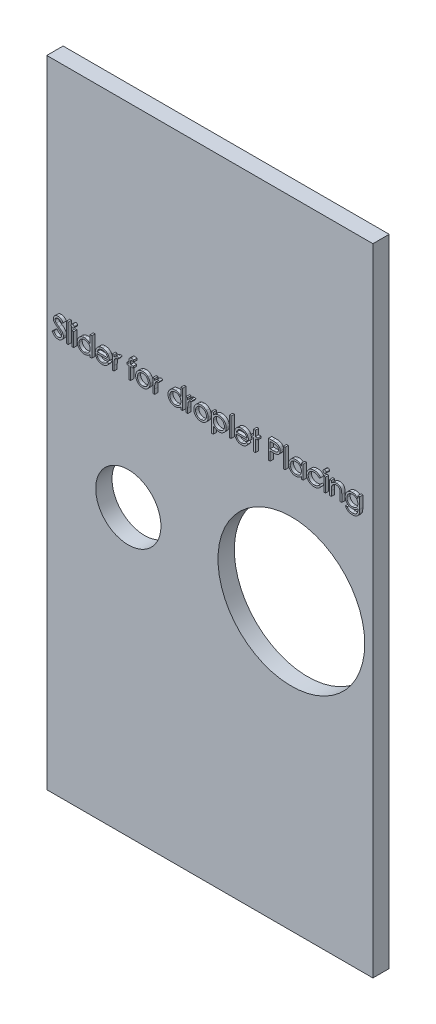
from build123d import *

# Parameters (mm, degrees)
SKETCH1_W           = 100
SKETCH1_H           = 195
SKETCH1_R           = 10
SKETCH1_R_2         = 22.5
BOSS_EXTRUDE1_DEPTH = 5
SKETCH2_W           = 0.522382478
SKETCH2_H           = 5.97008547
SKETCH2_H_2         = 4.253685897
SKETCH2_W_2         = 0.522382479
BOSS_EXTRUDE2_DEPTH = 1


with BuildPart() as part:
    # Sketch1 → Boss-Extrude1 (new body)
    with BuildSketch(Plane.XY):
        Rectangle(SKETCH1_W, SKETCH1_H)
        with Locations((-25, -10)):
            Circle(SKETCH1_R, mode=Mode.SUBTRACT)
        with Locations((25, -10)):
            Circle(SKETCH1_R_2, mode=Mode.SUBTRACT)
    extrude(amount=BOSS_EXTRUDE1_DEPTH)

    # Sketch2 → Boss-Extrude2 (add)
    # profile 1 of 25: a face of its own
    with BuildSketch(Plane.XY.offset(5)):
        with BuildLine():
            Line((-47.350240385, 26.122889123), (-46.858174746, 26.417895299))
            add(Edge.make_bspline(
                [(-46.858174746, 26.417895299), (-46.812409297, 26.34128584), (-46.724724462, 26.194505072), (-46.578452976, 25.996167593), (-46.426890265, 25.827592673), (-46.268913957, 25.689760982), (-46.105488326, 25.581245869), (-45.935546513, 25.504407157), (-45.759661202, 25.456483446), (-45.639961882, 25.450662469), (-45.580203325, 25.44775641)],
                knots=[0, 0, 0, 0, 1.272034388, 2.437168799, 3.508375237, 4.49857839, 5.41946034, 6.295179144, 7.148887113, 8, 8, 8, 8], degree=3))
            add(Edge.make_bspline(
                [(-45.580203325, 25.44775641), (-45.529168154, 25.449177812), (-45.427990806, 25.451995744), (-45.279040266, 25.479072269), (-45.134381245, 25.520669821), (-44.996995213, 25.580243442), (-44.868777864, 25.652319471), (-44.756341491, 25.73937615), (-44.659140038, 25.836843851), (-44.579628927, 25.945581433), (-44.518626535, 26.062525548), (-44.471740441, 26.182561029), (-44.445721193, 26.307573517), (-44.441801688, 26.391743537), (-44.439823718, 26.434219752)],
                knots=[0, 0, 0, 0, 1.095163259, 2.171163733, 3.241058638, 4.321873601, 5.38011039, 6.391990106, 7.366004449, 8.327778327, 9.272591725, 10.192022065, 11.087607919, 12, 12, 12, 12], degree=3))
            add(Edge.make_bspline(
                [(-44.439823718, 26.434219752), (-44.442275637, 26.48268376), (-44.44726003, 26.581204007), (-44.489388694, 26.726557954), (-44.555661787, 26.870403335), (-44.616801565, 26.959381035), (-44.648543503, 27.005575588)],
                knots=[0, 0, 0, 0, 0.938893495, 1.908633276, 2.914225137, 4, 4, 4, 4], degree=3))
            add(Edge.make_bspline(
                [(-44.648543503, 27.005575588), (-44.674605227, 27.038915364), (-44.729318556, 27.108908056), (-44.823379086, 27.213093048), (-44.933752254, 27.320559633), (-45.056660905, 27.435411422), (-45.196582244, 27.552306722), (-45.349133837, 27.676819799), (-45.518210516, 27.804215517), (-45.63678837, 27.889652986), (-45.697972589, 27.933737313)],
                knots=[0, 0, 0, 0, 0.722233717, 1.516239348, 2.393582979, 3.351407094, 4.387010283, 5.505090956, 6.712668013, 8, 8, 8, 8], degree=3))
            add(Edge.make_bspline(
                [(-45.697972589, 27.933737313), (-45.759214402, 27.977357952), (-45.876304085, 28.060757293), (-46.040050084, 28.184531965), (-46.186476411, 28.2976954), (-46.314932252, 28.401312906), (-46.425361105, 28.495398536), (-46.518633159, 28.579048799), (-46.592372402, 28.654525983), (-46.633376981, 28.703489738), (-46.651787026, 28.725473257)],
                knots=[0, 0, 0, 0, 1.452282411, 2.77665338, 3.964542531, 5.026858415, 5.96415736, 6.766646006, 7.446254459, 8, 8, 8, 8], degree=3))
            add(Edge.make_bspline(
                [(-46.651787026, 28.725473257), (-46.677519342, 28.759734744), (-46.728125396, 28.827114554), (-46.794925288, 28.932429824), (-46.851701967, 29.040237088), (-46.896210274, 29.150826044), (-46.933690153, 29.262644134), (-46.958899235, 29.377150312), (-46.974684332, 29.493830777), (-46.976300838, 29.572351325), (-46.977110043, 29.611657819)],
                knots=[0, 0, 0, 0, 1.068054152, 2.10047183, 3.106115577, 4.101338837, 5.06977816, 6.043150881, 7.020423561, 8, 8, 8, 8], degree=3))
            add(Edge.make_bspline(
                [(-46.977110043, 29.611657819), (-46.974939356, 29.673241861), (-46.970644379, 29.795093629), (-46.934321519, 29.973096093), (-46.876989814, 30.143041837), (-46.796670815, 30.303248356), (-46.693130908, 30.44954416), (-46.573311591, 30.583612067), (-46.430598917, 30.696317673), (-46.274014138, 30.794792965), (-46.102621576, 30.871870653), (-45.923022419, 30.930014093), (-45.734931217, 30.962958775), (-45.607532909, 30.967686563), (-45.542890291, 30.97008547)],
                knots=[0, 0, 0, 0, 1.005424448, 1.989358655, 2.955360095, 3.929531133, 4.905563448, 5.876582895, 6.856512386, 7.866279853, 8.892233794, 9.918561126, 10.94386622, 12, 12, 12, 12], degree=3))
            add(Edge.make_bspline(
                [(-45.542890291, 30.97008547), (-45.474297424, 30.967719631), (-45.337888105, 30.963014733), (-45.137236969, 30.922106696), (-44.944050635, 30.854417602), (-44.788645586, 30.777601465), (-44.667018839, 30.700880527), (-44.574263472, 30.630997558), (-44.480269569, 30.550545145), (-44.384278947, 30.459308994), (-44.287918112, 30.356451957), (-44.18975649, 30.242678466), (-44.089564533, 30.118683813), (-44.025109847, 30.030166399), (-43.992067308, 29.984788161)],
                knots=[0, 0, 0, 0, 1.286793592, 2.559021753, 3.825965368, 5.121522368, 5.803751409, 6.523245864, 7.299691795, 8.125521123, 9.008227632, 9.944561021, 10.946284179, 12, 12, 12, 12], degree=3))
            Line((-43.992067308, 29.984788161), (-44.464310397, 29.626816239))
            add(Edge.make_bspline(
                [(-44.464310397, 29.626816239), (-44.492825715, 29.663551835), (-44.547739552, 29.734296004), (-44.631109663, 29.833368775), (-44.709688664, 29.923868563), (-44.787106412, 30.002474972), (-44.859274154, 30.073492687), (-44.929318807, 30.134295044), (-44.996232365, 30.185477791), (-45.080579417, 30.240099759), (-45.186548051, 30.294244325), (-45.319569952, 30.340061065), (-45.458581888, 30.36759371), (-45.553261287, 30.371234039), (-45.601191907, 30.373076923)],
                knots=[0, 0, 0, 0, 1.181633172, 2.275549214, 3.290209073, 4.226197932, 5.078386478, 5.862611352, 6.581680152, 7.217281963, 8.414376989, 9.595101626, 10.782541182, 12, 12, 12, 12], degree=3))
            add(Edge.make_bspline(
                [(-45.601191907, 30.373076923), (-45.661323647, 30.371061751), (-45.777282044, 30.36717568), (-45.941912234, 30.324733514), (-46.090083917, 30.257907254), (-46.217398123, 30.164250082), (-46.323398786, 30.053286717), (-46.400076555, 29.925596169), (-46.446227721, 29.784594959), (-46.451859427, 29.686236751), (-46.454727564, 29.636144498)],
                knots=[0, 0, 0, 0, 1.14458467, 2.207223713, 3.21896685, 4.227309161, 5.202851033, 6.127160689, 7.046193047, 8, 8, 8, 8], degree=3))
            add(Edge.make_bspline(
                [(-46.454727564, 29.636144498), (-46.454073757, 29.604959003), (-46.452765074, 29.542537019), (-46.43451294, 29.450316024), (-46.411064413, 29.358327998), (-46.373906489, 29.266986512), (-46.322607811, 29.174694108), (-46.255243846, 29.079861528), (-46.17040385, 28.981652912), (-46.105415057, 28.917777792), (-46.071102931, 28.884053653)],
                knots=[0, 0, 0, 0, 0.858281714, 1.717966888, 2.583508476, 3.4729293, 4.427298488, 5.488583878, 6.674047936, 8, 8, 8, 8], degree=3))
            add(Edge.make_bspline(
                [(-46.071102931, 28.884053653), (-46.058361339, 28.872683027), (-46.028090233, 28.845669025), (-45.9727492, 28.80144353), (-45.899668141, 28.746889395), (-45.810755409, 28.679388823), (-45.704371594, 28.601087867), (-45.580504999, 28.512987705), (-45.440536355, 28.412228317), (-45.341213121, 28.341783693), (-45.288695246, 28.30453559)],
                knots=[0, 0, 0, 0, 0.420754252, 0.999615792, 1.744751191, 2.668019286, 3.750313428, 4.999500688, 6.413464383, 8, 8, 8, 8], degree=3))
            add(Edge.make_bspline(
                [(-45.288695246, 28.30453559), (-45.225521054, 28.258565377), (-45.103192988, 28.16955043), (-44.929137465, 28.035811495), (-44.771320025, 27.905012766), (-44.629186578, 27.777989531), (-44.501332958, 27.65570531), (-44.389177606, 27.536688925), (-44.29157773, 27.421793039), (-44.186504673, 27.27448841), (-44.07913887, 27.093575106), (-43.986934363, 26.871920703), (-43.928795302, 26.649404679), (-43.921192437, 26.499847786), (-43.917441239, 26.426057525)],
                knots=[0, 0, 0, 0, 1.163667725, 2.253281268, 3.268753668, 4.215851969, 5.092017293, 5.902905408, 6.650798638, 7.335211899, 8.59617414, 9.77448103, 10.901945474, 12, 12, 12, 12], degree=3))
            add(Edge.make_bspline(
                [(-43.917441239, 26.426057525), (-43.918534123, 26.373872316), (-43.920698666, 26.270515298), (-43.945580091, 26.118749414), (-43.982034581, 25.971347837), (-44.036978648, 25.83013257), (-44.1040399, 25.692520149), (-44.189134243, 25.562120344), (-44.287768572, 25.436047083), (-44.400915202, 25.317662158), (-44.524725828, 25.20898521), (-44.655584306, 25.112311045), (-44.793704819, 25.031703607), (-44.938338086, 24.96592679), (-45.089517329, 24.914481404), (-45.247191703, 24.877206668), (-45.411621117, 24.854329611), (-45.523381917, 24.851955108), (-45.580203325, 24.850747863)],
                knots=[0, 0, 0, 0, 0.983748083, 1.948392443, 2.894712957, 3.844097841, 4.80183111, 5.778335162, 6.776009319, 7.81870978, 8.863265674, 9.881300176, 10.883814829, 11.87499822, 12.874611388, 13.892143829, 14.928324115, 16, 16, 16, 16], degree=3))
            add(Edge.make_bspline(
                [(-45.580203325, 24.850747863), (-45.624167818, 24.851598007), (-45.711543117, 24.853287588), (-45.840781386, 24.868224312), (-45.967408774, 24.889357436), (-46.089836336, 24.922908835), (-46.209641413, 24.963616379), (-46.326302944, 25.013739297), (-46.439877471, 25.073805643), (-46.551001475, 25.142483201), (-46.659392334, 25.222407808), (-46.764033402, 25.315497063), (-46.868358011, 25.419183575), (-46.969286931, 25.536283048), (-47.068861672, 25.664903645), (-47.16511898, 25.806248752), (-47.260051312, 25.95954847), (-47.319615846, 26.067425285), (-47.350240385, 26.122889123)],
                knots=[0, 0, 0, 0, 0.915332311, 1.819136955, 2.706846663, 3.586547465, 4.459518054, 5.340707479, 6.227863349, 7.133153174, 8.059268498, 9.028702269, 10.047606654, 11.120612155, 12.245963614, 13.433783089, 14.680604001, 16, 16, 16, 16], degree=3))
        make_face()
    # profile 2 of 25: a face of its own
    with BuildSketch(Plane.XY.offset(5)):
        with Locations((-42.686111111, 27.985042735)):
            Rectangle(SKETCH2_W, SKETCH2_H)
    # profile 3 of 25: a face of its own
    with BuildSketch(Plane.XY.offset(5)):
        with BuildLine():
            add(Edge.make_bspline(
                [(-41.046669671, 31.044711538), (-41.014253757, 31.043207847), (-40.950777171, 31.04026333), (-40.85898551, 31.01504835), (-40.775403313, 30.972307325), (-40.701266297, 30.914964332), (-40.637649767, 30.847526746), (-40.593110895, 30.768927254), (-40.564485041, 30.684011875), (-40.561028205, 30.62478059), (-40.559268162, 30.594623064)],
                knots=[0, 0, 0, 0, 1.055194115, 2.066272739, 3.074728998, 4.095836921, 5.109056067, 6.073838105, 7.019297344, 8, 8, 8, 8], degree=3))
            add(Edge.make_bspline(
                [(-40.559268162, 30.594623064), (-40.561067897, 30.565248389), (-40.56462576, 30.507178134), (-40.593088784, 30.423734872), (-40.638029339, 30.34622751), (-40.701225504, 30.278920865), (-40.775414122, 30.221609571), (-40.858982638, 30.178860143), (-40.950777926, 30.15364739), (-41.014254012, 30.150702566), (-41.046669671, 30.149198718)],
                knots=[0, 0, 0, 0, 0.96129708, 1.900370562, 2.859976407, 3.87933698, 4.906634145, 5.921202961, 6.938410037, 8, 8, 8, 8], degree=3))
            add(Edge.make_bspline(
                [(-41.046669671, 30.149198718), (-41.078714648, 30.150645146), (-41.141086008, 30.153460428), (-41.231503245, 30.17935485), (-41.314372769, 30.2216242), (-41.388654373, 30.278545606), (-41.45057173, 30.346640869), (-41.495638826, 30.423687571), (-41.524036114, 30.507190177), (-41.527602835, 30.565252435), (-41.529407051, 30.594623064)],
                knots=[0, 0, 0, 0, 1.054934014, 2.053291228, 3.073705704, 4.106921865, 5.123545215, 6.088680038, 7.033164197, 8, 8, 8, 8], degree=3))
            add(Edge.make_bspline(
                [(-41.529407051, 30.594623064), (-41.527642363, 30.624776393), (-41.524176404, 30.683999435), (-41.49561754, 30.768975341), (-41.450947121, 30.847110053), (-41.388613375, 30.915339366), (-41.314383679, 30.972292785), (-41.231500426, 31.014553668), (-41.141086753, 31.040450288), (-41.078714901, 31.043265267), (-41.046669671, 31.044711538)],
                knots=[0, 0, 0, 0, 0.98631895, 1.937192651, 2.907499808, 3.917963147, 4.944918757, 5.95915025, 6.951458133, 8, 8, 8, 8], degree=3))
        make_face()
    # profile 4 of 25: a face of its own
    with BuildSketch(Plane.XY.offset(5)):
        with Locations((-41.044337607, 27.126842948)):
            Rectangle(SKETCH2_W, SKETCH2_H_2)
    # profile 5 of 25: a face of its own
    with BuildSketch(Plane.XY.offset(5)):
        with BuildLine():
            Line((-35.186191239, 30.97008547), (-35.186191239, 25))
            Line((-35.186191239, 25), (-35.708573718, 25))
            Line((-35.708573718, 25), (-35.708573718, 25.735766393))
            add(Edge.make_bspline(
                [(-35.708573718, 25.735766393), (-35.76747854, 25.669176735), (-35.882432041, 25.53922618), (-36.074421614, 25.369453805), (-36.277931548, 25.22912462), (-36.491974103, 25.11578482), (-36.716355991, 25.030647555), (-36.950579817, 24.970133907), (-37.194741125, 24.931227731), (-37.361470339, 24.927342704), (-37.445961872, 24.925373932)],
                knots=[0, 0, 0, 0, 1.074387032, 2.096679803, 3.090159297, 4.057316773, 5.018401886, 5.985159533, 6.978961417, 8, 8, 8, 8], degree=3))
            add(Edge.make_bspline(
                [(-37.445961872, 24.925373932), (-37.521080481, 24.927413506), (-37.669217704, 24.931435636), (-37.887131538, 24.962639133), (-38.096834958, 25.012749227), (-38.298526122, 25.082434396), (-38.490899917, 25.174870596), (-38.675603434, 25.285535029), (-38.851679804, 25.417320076), (-39.016445209, 25.567976595), (-39.168172714, 25.731616829), (-39.301322236, 25.906151269), (-39.412338965, 26.090825196), (-39.505173075, 26.283300453), (-39.576680091, 26.485058718), (-39.626529099, 26.695402293), (-39.657696247, 26.914082476), (-39.661716715, 27.06299523), (-39.663755342, 27.138503272)],
                knots=[0, 0, 0, 0, 1.033919861, 2.038935746, 3.024066025, 3.998881131, 4.97069526, 5.957263378, 6.95902576, 7.993208707, 9.027059324, 10.027763471, 11.009749337, 11.988697705, 12.965288445, 13.950418724, 14.960734635, 16, 16, 16, 16], degree=3))
            add(Edge.make_bspline(
                [(-39.663755342, 27.138503272), (-39.661671531, 27.212450646), (-39.65755195, 27.358640614), (-39.626862488, 27.573643401), (-39.575254965, 27.780729128), (-39.502830747, 27.979231092), (-39.409960257, 28.169389484), (-39.296989379, 28.351338798), (-39.163909954, 28.525580284), (-39.010485415, 28.688016836), (-38.844284375, 28.83806231), (-38.666484974, 28.96846402), (-38.481510064, 29.081083589), (-38.28649051, 29.17031443), (-38.084312837, 29.242507905), (-37.873177166, 29.292455591), (-37.653961957, 29.321887922), (-37.505130746, 29.326150042), (-37.42963742, 29.328311966)],
                knots=[0, 0, 0, 0, 1.020392517, 2.01726096, 2.990465484, 3.961182959, 4.928053699, 5.906110375, 6.912531644, 7.948652711, 8.985773172, 9.998621852, 10.987621588, 11.969261332, 12.953316658, 13.946091881, 14.958173133, 16, 16, 16, 16], degree=3))
            add(Edge.make_bspline(
                [(-37.42963742, 29.328311966), (-37.342795896, 29.325705736), (-37.172335634, 29.320589996), (-36.923040117, 29.27783786), (-36.687233817, 29.206053883), (-36.46355917, 29.107779454), (-36.253349653, 28.980052491), (-36.055064394, 28.825797999), (-35.872151654, 28.640650353), (-35.763931016, 28.501596343), (-35.708573718, 28.430467081)],
                knots=[0, 0, 0, 0, 1.031072012, 2.023879775, 2.993683497, 3.952812103, 4.918022106, 5.908088563, 6.929940113, 8, 8, 8, 8], degree=3))
            Line((-35.708573718, 28.430467081), (-35.708573718, 30.97008547))
            Line((-35.708573718, 30.97008547), (-35.186191239, 30.97008547))
        make_face()
        with BuildLine():
            add(Edge.make_bspline(
                [(-37.422641226, 28.805929487), (-37.499001143, 28.803212592), (-37.649723473, 28.797849873), (-37.870988319, 28.755983953), (-38.082722652, 28.686325884), (-38.283867492, 28.591060627), (-38.471245466, 28.471269978), (-38.638708631, 28.32637882), (-38.787626671, 28.160340357), (-38.912871487, 27.973903871), (-39.01496973, 27.77403626), (-39.086760615, 27.565110856), (-39.134107685, 27.350895911), (-39.138944831, 27.205603444), (-39.141372863, 27.13267311)],
                knots=[0, 0, 0, 0, 1.031046209, 2.035121221, 3.029706178, 4.034933723, 5.034054252, 6.02443088, 7.017295772, 8.038157696, 9.050218397, 10.03989886, 11.016116709, 12, 12, 12, 12], degree=3))
            add(Edge.make_bspline(
                [(-39.141372863, 27.13267311), (-39.138271368, 27.060178611), (-39.132080535, 26.915473765), (-39.087591582, 26.700966782), (-39.012952078, 26.491992143), (-38.911100695, 26.290323562), (-38.783563535, 26.103085481), (-38.63573324, 25.933881968), (-38.466180213, 25.78837845), (-38.278371014, 25.66657739), (-38.077788472, 25.568184483), (-37.866851565, 25.499722104), (-37.649525533, 25.455520724), (-37.50175564, 25.450357683), (-37.427305355, 25.44775641)],
                knots=[0, 0, 0, 0, 0.979072187, 1.954306742, 2.945804271, 3.96968567, 4.997920485, 5.998718438, 6.996577872, 8.005894225, 9.015743152, 10.005417472, 10.995077863, 12, 12, 12, 12], degree=3))
            add(Edge.make_bspline(
                [(-37.427305355, 25.44775641), (-37.351723493, 25.450517088), (-37.201398665, 25.456007803), (-36.979477385, 25.498052955), (-36.764114929, 25.567518445), (-36.558244979, 25.663810207), (-36.366463271, 25.783149524), (-36.194336443, 25.922861317), (-36.048789053, 26.085351017), (-35.925399677, 26.263928285), (-35.828648419, 26.459694546), (-35.758172997, 26.668137241), (-35.716505965, 26.889263628), (-35.71125436, 27.040378993), (-35.708573718, 27.11751469)],
                knots=[0, 0, 0, 0, 1.01762866, 2.023962475, 3.030623092, 4.058876274, 5.077231937, 6.066672613, 7.034107872, 8.005628644, 8.981990164, 9.965428785, 10.961468474, 12, 12, 12, 12], degree=3))
            add(Edge.make_bspline(
                [(-35.708573718, 27.11751469), (-35.710169718, 27.176284868), (-35.713311151, 27.291963176), (-35.737310562, 27.461810964), (-35.775486791, 27.624351458), (-35.829281552, 27.779755549), (-35.899948605, 27.927164021), (-35.985178521, 28.067635299), (-36.086470084, 28.200438794), (-36.202192735, 28.323745783), (-36.32886272, 28.43621503), (-36.462899117, 28.536606511), (-36.605889962, 28.619077363), (-36.755430558, 28.687332906), (-36.91178036, 28.741648183), (-37.076211617, 28.777883193), (-37.246976551, 28.802763631), (-37.363469813, 28.804863091), (-37.422641226, 28.805929487)],
                knots=[0, 0, 0, 0, 1.050140795, 2.067009409, 3.05949893, 4.030605086, 5.00011959, 5.97591094, 6.962425594, 7.979863591, 8.993523472, 9.986985069, 10.967611495, 11.937549037, 12.921786183, 13.919465291, 14.943216303, 16, 16, 16, 16], degree=3))
        make_face(mode=Mode.SUBTRACT)
    # profile 6 of 25: a face of its own
    with BuildSketch(Plane.XY.offset(5)):
        with BuildLine():
            Line((-30.501073384, 26.343269231), (-30.036992521, 26.099568476))
            add(Edge.make_bspline(
                [(-30.036992521, 26.099568476), (-30.073974097, 26.03397046), (-30.145925598, 25.906342697), (-30.269661128, 25.730999472), (-30.399369372, 25.573258687), (-30.540905376, 25.437334489), (-30.690034592, 25.31883665), (-30.847584019, 25.21516291), (-31.014373875, 25.126821752), (-31.190412048, 25.052394036), (-31.377176897, 24.99516777), (-31.575121014, 24.954747536), (-31.784623608, 24.929762409), (-31.928225528, 24.926860074), (-32.001756978, 24.925373932)],
                knots=[0, 0, 0, 0, 1.120438281, 2.179929193, 3.190490725, 4.156257408, 5.095198341, 6.022838206, 6.959905092, 7.901321166, 8.864066838, 9.862729781, 10.905609505, 12, 12, 12, 12], degree=3))
            add(Edge.make_bspline(
                [(-32.001756978, 24.925373932), (-32.083484767, 24.927281793), (-32.242912006, 24.931003479), (-32.474979895, 24.963088685), (-32.69347638, 25.015430215), (-32.898389177, 25.088549097), (-33.089216471, 25.184056207), (-33.266337536, 25.300405488), (-33.430683818, 25.436999249), (-33.577076462, 25.595020644), (-33.708866586, 25.764127423), (-33.825159884, 25.94034215), (-33.922380159, 26.123221465), (-34.001464679, 26.311601134), (-34.065335627, 26.504293824), (-34.109851204, 26.703052776), (-34.135512345, 26.907340052), (-34.139444643, 27.045538835), (-34.141426282, 27.115182626)],
                knots=[0, 0, 0, 0, 1.145258523, 2.234067595, 3.276747158, 4.290159414, 5.277019952, 6.260822364, 7.254936242, 8.264827045, 9.274100331, 10.257902744, 11.220704747, 12.172965371, 13.118907548, 14.062713208, 15.023725156, 16, 16, 16, 16], degree=3))
            add(Edge.make_bspline(
                [(-34.141426282, 27.115182626), (-34.139664829, 27.180533671), (-34.136173862, 27.310050813), (-34.114169803, 27.501748391), (-34.075173058, 27.688062377), (-34.021660767, 27.869147584), (-33.952557087, 28.044700814), (-33.868018266, 28.21482891), (-33.767912609, 28.379350839), (-33.690624126, 28.483133194), (-33.651692708, 28.535409989)],
                knots=[0, 0, 0, 0, 1.024358464, 2.0301432, 3.019427413, 4.004406732, 4.986367066, 5.972626655, 6.978780325, 8, 8, 8, 8], degree=3))
            add(Edge.make_bspline(
                [(-33.651692708, 28.535409989), (-33.598959812, 28.598389527), (-33.495164464, 28.72235357), (-33.319614192, 28.885234333), (-33.12952208, 29.021680945), (-32.927270364, 29.134783289), (-32.710508394, 29.220721485), (-32.482149966, 29.284763262), (-32.239594866, 29.32064955), (-32.073775588, 29.325718387), (-31.988930622, 29.328311966)],
                knots=[0, 0, 0, 0, 1.030682036, 2.02871468, 2.997146059, 3.962720338, 4.930598197, 5.918074684, 6.934738563, 8, 8, 8, 8], degree=3))
            add(Edge.make_bspline(
                [(-31.988930622, 29.328311966), (-31.90170526, 29.326060054), (-31.730588982, 29.321642315), (-31.481071276, 29.280686377), (-31.244977084, 29.21573826), (-31.022400883, 29.124012253), (-30.813320108, 29.005667142), (-30.619093785, 28.859078865), (-30.436400257, 28.688747832), (-30.330114204, 28.557757113), (-30.276029147, 28.491100761)],
                knots=[0, 0, 0, 0, 1.056321875, 2.072262726, 3.055038591, 4.01806755, 4.982017516, 5.957941055, 6.960871419, 8, 8, 8, 8], degree=3))
            add(Edge.make_bspline(
                [(-30.276029147, 28.491100761), (-30.239229941, 28.440869329), (-30.165876476, 28.34074082), (-30.073995287, 28.177472836), (-29.994237572, 28.006655335), (-29.930486207, 27.825527139), (-29.87886456, 27.636234337), (-29.841516732, 27.4374237), (-29.819614402, 27.229154431), (-29.815309152, 27.087248243), (-29.813114316, 27.014903846)],
                knots=[0, 0, 0, 0, 0.94817472, 1.890038105, 2.849395472, 3.817997239, 4.812318967, 5.836947057, 6.897266129, 8, 8, 8, 8], degree=3))
            Line((-29.813114316, 27.014903846), (-33.619043803, 27.014903846))
            add(Edge.make_bspline(
                [(-33.619043803, 27.014903846), (-33.616483291, 26.958856765), (-33.611448147, 26.848642439), (-33.58797332, 26.687370791), (-33.55097149, 26.533745126), (-33.498968061, 26.388917734), (-33.435991891, 26.250997033), (-33.358848026, 26.121006122), (-33.266813078, 25.999537088), (-33.164157361, 25.885503408), (-33.049890918, 25.783953547), (-32.929677825, 25.693062438), (-32.801796504, 25.616883368), (-32.667255286, 25.555049671), (-32.526271734, 25.506643095), (-32.378801428, 25.473601017), (-32.225134561, 25.451470031), (-32.120383287, 25.449009207), (-32.067054788, 25.44775641)],
                knots=[0, 0, 0, 0, 1.094153842, 2.151609401, 3.174256925, 4.172055639, 5.149267565, 6.128595816, 7.11444997, 8.118368179, 9.117203808, 10.09244225, 11.054858984, 12.015122123, 12.976791628, 13.957293641, 14.960065497, 16, 16, 16, 16], degree=3))
            add(Edge.make_bspline(
                [(-32.067054788, 25.44775641), (-32.014914843, 25.448767666), (-31.911459192, 25.450774193), (-31.757388623, 25.470285478), (-31.605814909, 25.501834853), (-31.457365393, 25.544892372), (-31.315052927, 25.597407684), (-31.18326003, 25.660776365), (-31.06205329, 25.730875409), (-30.948768287, 25.81105269), (-30.838885933, 25.909188924), (-30.729882536, 26.031652141), (-30.613005768, 26.176486994), (-30.539846886, 26.285495679), (-30.501073384, 26.343269231)],
                knots=[0, 0, 0, 0, 0.99110716, 1.966546729, 2.947904876, 3.932708344, 4.903319531, 5.828989031, 6.710028674, 7.56322171, 8.463672341, 9.504779593, 10.677557249, 12, 12, 12, 12], degree=3))
        make_face()
        with BuildLine():
            add(Edge.make_bspline(
                [(-30.335496795, 27.537286325), (-30.354616776, 27.606575652), (-30.391416586, 27.739935302), (-30.468312064, 27.924606878), (-30.554911995, 28.088734256), (-30.657394803, 28.231061336), (-30.773509993, 28.357462417), (-30.907630612, 28.467922849), (-31.058034116, 28.566739729), (-31.223943068, 28.650148112), (-31.399635418, 28.721145413), (-31.583584049, 28.768751707), (-31.771277299, 28.801364243), (-31.898228487, 28.804401235), (-31.962111879, 28.805929487)],
                knots=[0, 0, 0, 0, 1.154881502, 2.222775134, 3.210006277, 4.132804581, 5.035138423, 5.962687519, 6.919655026, 7.923214229, 8.944639381, 9.960483929, 10.97369054, 12, 12, 12, 12], degree=3))
            add(Edge.make_bspline(
                [(-31.962111879, 28.805929487), (-32.014248981, 28.804912219), (-32.11731307, 28.802901294), (-32.269155442, 28.783825377), (-32.414975132, 28.752293349), (-32.555848092, 28.709111153), (-32.689928274, 28.651553751), (-32.819973621, 28.58405998), (-32.942677447, 28.501667608), (-33.019414815, 28.438871037), (-33.058182258, 28.407146434)],
                knots=[0, 0, 0, 0, 1.04873581, 2.073130211, 3.073294108, 4.04793562, 5.032784715, 6.005352987, 6.992311501, 8, 8, 8, 8], degree=3))
            add(Edge.make_bspline(
                [(-33.058182258, 28.407146434), (-33.085944776, 28.38204315), (-33.142129346, 28.33124022), (-33.217202332, 28.243712838), (-33.289082094, 28.149329585), (-33.354497705, 28.044479538), (-33.414498167, 27.930356647), (-33.470644224, 27.807923509), (-33.521179722, 27.676251053), (-33.549612181, 27.584494032), (-33.564240284, 27.537286325)],
                knots=[0, 0, 0, 0, 0.879870761, 1.780643979, 2.707998968, 3.669668524, 4.684282772, 5.740141944, 6.837334558, 8, 8, 8, 8], degree=3))
            Line((-33.564240284, 27.537286325), (-30.335496795, 27.537286325))
        make_face(mode=Mode.SUBTRACT)
    # profile 7 of 25: a face of its own
    with BuildSketch(Plane.XY.offset(5)):
        with BuildLine():
            Line((-28.917601496, 29.253685897), (-28.395219017, 29.253685897))
            Line((-28.395219017, 29.253685897), (-28.395219017, 28.627526542))
            add(Edge.make_bspline(
                [(-28.395219017, 28.627526542), (-28.356653903, 28.685827724), (-28.282898421, 28.79732828), (-28.1603068, 28.944793772), (-28.034737569, 29.066889986), (-27.905589597, 29.16418691), (-27.771913162, 29.237052299), (-27.636642064, 29.290426073), (-27.497648099, 29.321987155), (-27.40424547, 29.326200872), (-27.357450254, 29.328311966)],
                knots=[0, 0, 0, 0, 1.2804753, 2.448899062, 3.506932113, 4.484331642, 5.4025378, 6.288909075, 7.142734305, 8, 8, 8, 8], degree=3))
            add(Edge.make_bspline(
                [(-27.357450254, 29.328311966), (-27.321150994, 29.326332007), (-27.246462908, 29.322258112), (-27.133401387, 29.293634872), (-27.016912456, 29.247936303), (-26.941836366, 29.204961552), (-26.90269765, 29.182557926)],
                knots=[0, 0, 0, 0, 0.901110191, 1.854092781, 2.881294221, 4, 4, 4, 4], degree=3))
            Line((-26.90269765, 29.182557926), (-27.1895416, 28.730137386))
            add(Edge.make_bspline(
                [(-27.1895416, 28.730137386), (-27.214669341, 28.741347091), (-27.262366604, 28.762625256), (-27.332141043, 28.787807861), (-27.39647179, 28.802635878), (-27.437456375, 28.80488225), (-27.456563001, 28.805929487)],
                knots=[0, 0, 0, 0, 1.180555205, 2.24091978, 3.179933427, 4, 4, 4, 4], degree=3))
            add(Edge.make_bspline(
                [(-27.456563001, 28.805929487), (-27.498482536, 28.803135425), (-27.583986237, 28.797436348), (-27.709524149, 28.752634545), (-27.831341227, 28.680247926), (-27.928086242, 28.599968469), (-28.002995798, 28.522555049), (-28.056448054, 28.454952884), (-28.10548067, 28.379151279), (-28.15233043, 28.296446079), (-28.195015921, 28.205425133), (-28.234854818, 28.106997812), (-28.270875569, 28.001050116), (-28.291415202, 27.927237758), (-28.301936432, 27.889428085)],
                knots=[0, 0, 0, 0, 1.125678352, 2.296057538, 3.5422874, 4.923748041, 5.663163013, 6.437101912, 7.23742474, 8.08941207, 8.991984279, 9.93940061, 10.944477711, 12, 12, 12, 12], degree=3))
            add(Edge.make_bspline(
                [(-28.301936432, 27.889428085), (-28.309806852, 27.855705214), (-28.327239237, 27.781011618), (-28.344188735, 27.655699845), (-28.360935302, 27.507645022), (-28.372737654, 27.336435034), (-28.383677565, 27.142497434), (-28.389847785, 26.925536772), (-28.395008603, 26.685330353), (-28.395146751, 26.517400387), (-28.395219017, 26.429555622)],
                knots=[0, 0, 0, 0, 0.566838948, 1.255505196, 2.06880316, 3.007127437, 4.065329342, 5.249902469, 6.561414163, 8, 8, 8, 8], degree=3))
            Line((-28.395219017, 26.429555622), (-28.395219017, 25))
            Line((-28.395219017, 25), (-28.917601496, 25))
            Line((-28.917601496, 25), (-28.917601496, 29.253685897))
        make_face()
    # profile 8 of 25: a face of its own
    with BuildSketch(Plane.XY.offset(5)):
        with BuildLine():
            Line((-22.350507479, 30.935104501), (-22.350507479, 30.39173344))
            add(Edge.make_bspline(
                [(-22.350507479, 30.39173344), (-22.399965901, 30.411608879), (-22.493839014, 30.449332875), (-22.632275687, 30.490352496), (-22.759550425, 30.516855149), (-22.841298026, 30.520573738), (-22.879886151, 30.52232906)],
                knots=[0, 0, 0, 0, 1.16548392, 2.212112691, 3.15604595, 4, 4, 4, 4], degree=3))
            add(Edge.make_bspline(
                [(-22.879886151, 30.52232906), (-22.905953114, 30.521245819), (-22.956410058, 30.519149026), (-23.028926543, 30.508458192), (-23.094268241, 30.486666986), (-23.152319612, 30.458345677), (-23.200466984, 30.422831635), (-23.241688836, 30.387149488), (-23.271568885, 30.34692723), (-23.287792292, 30.309473643), (-23.29768771, 30.274796455), (-23.300664864, 30.239282277), (-23.307957394, 30.195669124), (-23.309991038, 30.142177798), (-23.314626697, 30.080472456), (-23.31421651, 30.009247249), (-23.318014891, 29.929623), (-23.317446255, 29.873243159), (-23.317148271, 29.843698251)],
                knots=[0, 0, 0, 0, 1.311993654, 2.539582093, 3.670788641, 4.763509788, 5.772417512, 6.671800701, 7.496729179, 8.266799162, 8.712543678, 9.304149002, 10.05334463, 10.934920737, 11.99209668, 13.165090968, 14.514413552, 16, 16, 16, 16], degree=3))
            Line((-23.317148271, 29.843698251), (-23.317148271, 29.253685897))
            Line((-23.317148271, 29.253685897), (-22.425133547, 29.253685897))
            Line((-22.425133547, 29.253685897), (-22.425133547, 28.731303419))
            Line((-22.425133547, 28.731303419), (-23.318314303, 28.731303419))
            Line((-23.318314303, 28.731303419), (-23.320646368, 25))
            Line((-23.320646368, 25), (-23.843028846, 25))
            Line((-23.843028846, 25), (-23.843028846, 28.731303419))
            Line((-23.843028846, 28.731303419), (-24.440037393, 28.731303419))
            Line((-24.440037393, 28.731303419), (-24.440037393, 29.253685897))
            Line((-24.440037393, 29.253685897), (-23.843028846, 29.253685897))
            Line((-23.843028846, 29.253685897), (-23.843028846, 29.933482739))
            add(Edge.make_bspline(
                [(-23.843028846, 29.933482739), (-23.842986912, 29.971194388), (-23.842906466, 30.043540535), (-23.837272147, 30.147665997), (-23.832456289, 30.243831925), (-23.822864174, 30.33129183), (-23.811785123, 30.410864523), (-23.795925582, 30.481367921), (-23.780938813, 30.544701514), (-23.753749547, 30.616385337), (-23.713133071, 30.69762758), (-23.647390589, 30.783483041), (-23.568571504, 30.860492578), (-23.474426471, 30.925365522), (-23.368461468, 30.979275548), (-23.250579318, 31.017928963), (-23.122063305, 31.039782775), (-23.033108548, 31.043032811), (-22.987161124, 31.044711538)],
                knots=[0, 0, 0, 0, 1.116398763, 2.141702935, 3.087165306, 3.966655413, 4.746276475, 5.464069668, 6.106083417, 6.67047701, 7.730773247, 8.782666744, 9.856985883, 10.980834087, 12.154321827, 13.366232824, 14.639591414, 16, 16, 16, 16], degree=3))
            add(Edge.make_bspline(
                [(-22.987161124, 31.044711538), (-22.940466802, 31.043119323), (-22.842434548, 31.039776552), (-22.689102817, 31.019098611), (-22.523464323, 30.983390244), (-22.409815179, 30.951661905), (-22.350507479, 30.935104501)],
                knots=[0, 0, 0, 0, 0.864728408, 1.815451418, 2.859995356, 4, 4, 4, 4], degree=3))
        make_face()
    # profile 9 of 25: a face of its own
    with BuildSketch(Plane.XY.offset(5)):
        with BuildLine():
            add(Edge.make_bspline(
                [(-19.54969785, 29.328311966), (-19.469883793, 29.326612464), (-19.313387932, 29.323280155), (-19.084200293, 29.287665027), (-18.865428204, 29.233203042), (-18.656233787, 29.157912122), (-18.459296209, 29.056992259), (-18.27174689, 28.936568712), (-18.094100032, 28.793904089), (-17.987623636, 28.683544302), (-17.933577057, 28.627526542)],
                knots=[0, 0, 0, 0, 1.054011418, 2.066658804, 3.057071809, 4.030435133, 4.997543892, 5.974964718, 6.972108034, 8, 8, 8, 8], degree=3))
            add(Edge.make_bspline(
                [(-17.933577057, 28.627526542), (-17.887040402, 28.573951616), (-17.794867705, 28.467838586), (-17.676678647, 28.295782049), (-17.574861362, 28.117597857), (-17.493264985, 27.930919863), (-17.428928106, 27.737377701), (-17.383250038, 27.536306142), (-17.356080159, 27.328149239), (-17.352416415, 27.186779761), (-17.350560897, 27.115182626)],
                knots=[0, 0, 0, 0, 1.025258237, 2.030674902, 3.01204498, 3.988269485, 4.97094183, 5.956517959, 6.965070386, 8, 8, 8, 8], degree=3))
            add(Edge.make_bspline(
                [(-17.350560897, 27.115182626), (-17.352192955, 27.043170506), (-17.355417976, 26.900871199), (-17.385925158, 26.691288992), (-17.433375071, 26.488067364), (-17.501282306, 26.292057132), (-17.588358828, 26.102659144), (-17.694615127, 25.920700643), (-17.820796852, 25.745822631), (-17.963829689, 25.57951005), (-18.121910012, 25.426228857), (-18.293401987, 25.292635295), (-18.474935541, 25.178178545), (-18.668924546, 25.085982506), (-18.873597498, 25.013289112), (-19.08939586, 24.962232061), (-19.315984387, 24.931362213), (-19.470697516, 24.927398103), (-19.54969785, 24.925373932)],
                knots=[0, 0, 0, 0, 0.998656419, 1.973391657, 2.932242238, 3.890759089, 4.846373663, 5.82037756, 6.809684879, 7.83454468, 8.860553229, 9.859544525, 10.845671541, 11.83227036, 12.833544569, 13.85385346, 14.904124723, 16, 16, 16, 16], degree=3))
            add(Edge.make_bspline(
                [(-19.54969785, 24.925373932), (-19.629085235, 24.927404897), (-19.784569438, 24.931382646), (-20.011957768, 24.962112127), (-20.228142884, 25.013265581), (-20.433083779, 25.0862214), (-20.627906816, 25.178181492), (-20.810492217, 25.292289266), (-20.982123505, 25.426268477), (-21.140237269, 25.579499315), (-21.28326114, 25.745825397), (-21.409445179, 25.920699925), (-21.515700876, 26.102659331), (-21.602777556, 26.292057082), (-21.67068475, 26.488067377), (-21.718134674, 26.691288988), (-21.748641852, 26.9008712), (-21.751866874, 27.043170506), (-21.753498932, 27.115182626)],
                knots=[0, 0, 0, 0, 1.099876186, 2.154163076, 3.173186993, 4.173200201, 5.163417411, 6.152872554, 7.150605724, 8.17532212, 9.198891216, 10.186952605, 11.159729845, 12.11414092, 13.071450619, 14.029093627, 15.002601286, 16, 16, 16, 16], degree=3))
            add(Edge.make_bspline(
                [(-21.753498932, 27.115182626), (-21.75163076, 27.186390619), (-21.7479321, 27.327370209), (-21.720789539, 27.535135808), (-21.675289654, 27.735867061), (-21.610875653, 27.928662168), (-21.528527175, 28.114522102), (-21.428140604, 28.293146565), (-21.308745945, 28.464425085), (-21.216939842, 28.570400973), (-21.170482772, 28.624028446)],
                knots=[0, 0, 0, 0, 1.031353054, 2.041901799, 3.029428768, 4.008703097, 4.981709435, 5.96992636, 6.972712378, 8, 8, 8, 8], degree=3))
            add(Edge.make_bspline(
                [(-21.170482772, 28.624028446), (-21.116517675, 28.680532005), (-21.010385816, 28.791656198), (-20.831854658, 28.933904931), (-20.64476672, 29.056834402), (-20.445652765, 29.155749012), (-20.236630203, 29.233645928), (-20.01673701, 29.287805481), (-19.786771659, 29.323151835), (-19.629510003, 29.32657478), (-19.54969785, 29.328311966)],
                knots=[0, 0, 0, 0, 1.027980169, 2.021703884, 2.998553061, 3.971491411, 4.943284454, 5.930300938, 6.949603206, 8, 8, 8, 8], degree=3))
        make_face()
        with BuildLine():
            add(Edge.make_bspline(
                [(-19.552029915, 28.805929487), (-19.608471394, 28.804325279), (-19.719897326, 28.801158276), (-19.883911088, 28.777070163), (-20.041805606, 28.738906278), (-20.193880438, 28.684682628), (-20.33962275, 28.614668149), (-20.479172078, 28.528672222), (-20.612938885, 28.427833841), (-20.738306436, 28.312310802), (-20.85336321, 28.186116808), (-20.953943845, 28.051658287), (-21.039468694, 27.911116185), (-21.110715959, 27.764344353), (-21.163780651, 27.609855422), (-21.202319595, 27.449398943), (-21.226384983, 27.282648007), (-21.22952221, 27.169289742), (-21.231116453, 27.111684529)],
                knots=[0, 0, 0, 0, 1.021534396, 2.016698045, 2.994645724, 3.958388632, 4.93408049, 5.916473867, 6.921342795, 7.962252576, 8.998418191, 10.008913653, 10.997312074, 11.973003931, 12.956656626, 13.948281152, 14.957379055, 16, 16, 16, 16], degree=3))
            add(Edge.make_bspline(
                [(-21.231116453, 27.111684529), (-21.228444152, 27.037257645), (-21.223140135, 26.889534199), (-21.180007367, 26.671982844), (-21.107851851, 26.463128264), (-21.010415625, 26.264194822), (-20.888334093, 26.080136283), (-20.744497864, 25.916036208), (-20.580450648, 25.77436409), (-20.398147968, 25.656815113), (-20.201313466, 25.56341609), (-19.993000275, 25.497226603), (-19.775732359, 25.454199515), (-19.62725, 25.449922908), (-19.552029915, 25.44775641)],
                knots=[0, 0, 0, 0, 1.016792936, 2.018143844, 3.017858371, 4.030088057, 5.03801393, 6.028138512, 7.003788237, 7.991172063, 8.984598303, 9.972568034, 10.972917682, 12, 12, 12, 12], degree=3))
            add(Edge.make_bspline(
                [(-19.552029915, 25.44775641), (-19.476814156, 25.449935531), (-19.328340337, 25.454237055), (-19.111374301, 25.497009902), (-18.90363047, 25.563706109), (-18.707000412, 25.65671007), (-18.524780716, 25.774810479), (-18.359553665, 25.915236215), (-18.216945558, 26.080570918), (-18.094984789, 26.264438618), (-17.995952885, 26.462819856), (-17.924135108, 26.672021391), (-17.880898646, 26.889524382), (-17.875608625, 27.037254356), (-17.872943376, 27.111684529)],
                knots=[0, 0, 0, 0, 1.02726834, 2.027799167, 3.010890988, 4.004497153, 4.992059811, 5.971914811, 6.958719428, 7.966827853, 8.981595046, 9.981490638, 10.983022906, 12, 12, 12, 12], degree=3))
            add(Edge.make_bspline(
                [(-17.872943376, 27.111684529), (-17.87453707, 27.169290086), (-17.877673218, 27.282649028), (-17.901746462, 27.449395037), (-17.94025633, 27.609869752), (-17.993428174, 27.764291477), (-18.064365861, 27.911496201), (-18.15153998, 28.05124564), (-18.251709912, 28.186582586), (-18.368155052, 28.311902868), (-18.493391741, 28.427878875), (-18.627212763, 28.528711324), (-18.766555162, 28.614290206), (-18.911874067, 28.685281489), (-19.063968397, 28.738412959), (-19.221641682, 28.777290523), (-19.384955655, 28.801056481), (-19.495982302, 28.804294763), (-19.552029915, 28.805929487)],
                knots=[0, 0, 0, 0, 1.042956736, 2.052379634, 3.044323526, 4.02829302, 5.004299113, 5.996692471, 7.007513377, 8.048758398, 9.090003419, 10.095195979, 11.07790575, 12.047570684, 13.018257071, 13.989683339, 14.985167495, 16, 16, 16, 16], degree=3))
        make_face(mode=Mode.SUBTRACT)
    # profile 10 of 25: a face of its own
    with BuildSketch(Plane.XY.offset(5)):
        with BuildLine():
            Line((-16.455048077, 29.253685897), (-15.932665598, 29.253685897))
            Line((-15.932665598, 29.253685897), (-15.932665598, 28.627526542))
            add(Edge.make_bspline(
                [(-15.932665598, 28.627526542), (-15.894100484, 28.685827724), (-15.820345003, 28.79732828), (-15.697753381, 28.944793772), (-15.57218415, 29.066889986), (-15.443036178, 29.16418691), (-15.309359743, 29.237052299), (-15.174088646, 29.290426073), (-15.03509468, 29.321987155), (-14.941692051, 29.326200872), (-14.894896835, 29.328311966)],
                knots=[0, 0, 0, 0, 1.2804753, 2.448899062, 3.506932113, 4.484331642, 5.4025378, 6.288909075, 7.142734305, 8, 8, 8, 8], degree=3))
            add(Edge.make_bspline(
                [(-14.894896835, 29.328311966), (-14.858597575, 29.326332007), (-14.78390949, 29.322258112), (-14.670847968, 29.293634872), (-14.554359037, 29.247936303), (-14.479282948, 29.204961552), (-14.440144231, 29.182557926)],
                knots=[0, 0, 0, 0, 0.901110191, 1.854092781, 2.881294221, 4, 4, 4, 4], degree=3))
            Line((-14.440144231, 29.182557926), (-14.726988181, 28.730137386))
            add(Edge.make_bspline(
                [(-14.726988181, 28.730137386), (-14.752115922, 28.741347091), (-14.799813185, 28.762625256), (-14.869587625, 28.787807861), (-14.933918371, 28.802635878), (-14.974902956, 28.80488225), (-14.994009582, 28.805929487)],
                knots=[0, 0, 0, 0, 1.180555205, 2.24091978, 3.179933427, 4, 4, 4, 4], degree=3))
            add(Edge.make_bspline(
                [(-14.994009582, 28.805929487), (-15.035929117, 28.803135425), (-15.121432818, 28.797436348), (-15.24697073, 28.752634545), (-15.368787808, 28.680247926), (-15.465532823, 28.599968469), (-15.540442379, 28.522555049), (-15.593894635, 28.454952884), (-15.642927251, 28.379151279), (-15.689777011, 28.296446079), (-15.732462503, 28.205425133), (-15.772301399, 28.106997812), (-15.808322151, 28.001050116), (-15.828861783, 27.927237758), (-15.839383013, 27.889428085)],
                knots=[0, 0, 0, 0, 1.125678352, 2.296057538, 3.5422874, 4.923748041, 5.663163013, 6.437101912, 7.23742474, 8.08941207, 8.991984279, 9.93940061, 10.944477711, 12, 12, 12, 12], degree=3))
            add(Edge.make_bspline(
                [(-15.839383013, 27.889428085), (-15.847253434, 27.855705214), (-15.864685818, 27.781011618), (-15.881635316, 27.655699845), (-15.898381883, 27.507645022), (-15.910184235, 27.336435034), (-15.921124146, 27.142497434), (-15.927294366, 26.925536772), (-15.932455184, 26.685330353), (-15.932593333, 26.517400387), (-15.932665598, 26.429555622)],
                knots=[0, 0, 0, 0, 0.566838948, 1.255505196, 2.06880316, 3.007127437, 4.065329342, 5.249902469, 6.561414163, 8, 8, 8, 8], degree=3))
            Line((-15.932665598, 26.429555622), (-15.932665598, 25))
            Line((-15.932665598, 25), (-16.455048077, 25))
            Line((-16.455048077, 25), (-16.455048077, 29.253685897))
        make_face()
    # profile 11 of 25: a face of its own
    with BuildSketch(Plane.XY.offset(5)):
        with BuildLine():
            Line((-7.350667735, 30.97008547), (-7.350667735, 25))
            Line((-7.350667735, 25), (-7.873050214, 25))
            Line((-7.873050214, 25), (-7.873050214, 25.735766393))
            add(Edge.make_bspline(
                [(-7.873050214, 25.735766393), (-7.931955036, 25.669176735), (-8.046908537, 25.53922618), (-8.23889811, 25.369453805), (-8.442408044, 25.22912462), (-8.656450598, 25.11578482), (-8.880832486, 25.030647555), (-9.115056313, 24.970133907), (-9.359217621, 24.931227731), (-9.525946835, 24.927342704), (-9.610438368, 24.925373932)],
                knots=[0, 0, 0, 0, 1.074387032, 2.096679803, 3.090159297, 4.057316773, 5.018401886, 5.985159533, 6.978961417, 8, 8, 8, 8], degree=3))
            add(Edge.make_bspline(
                [(-9.610438368, 24.925373932), (-9.685556977, 24.927413506), (-9.8336942, 24.931435636), (-10.051608034, 24.962639133), (-10.261311454, 25.012749227), (-10.463002618, 25.082434396), (-10.655376412, 25.174870596), (-10.84007993, 25.285535029), (-11.0161563, 25.417320076), (-11.180921705, 25.567976595), (-11.33264921, 25.731616829), (-11.465798731, 25.906151269), (-11.576815461, 26.090825196), (-11.669649571, 26.283300453), (-11.741156587, 26.485058718), (-11.791005595, 26.695402293), (-11.822172743, 26.914082476), (-11.82619321, 27.06299523), (-11.828231838, 27.138503272)],
                knots=[0, 0, 0, 0, 1.033919861, 2.038935746, 3.024066025, 3.998881131, 4.97069526, 5.957263378, 6.95902576, 7.993208707, 9.027059324, 10.027763471, 11.009749337, 11.988697705, 12.965288445, 13.950418724, 14.960734635, 16, 16, 16, 16], degree=3))
            add(Edge.make_bspline(
                [(-11.828231838, 27.138503272), (-11.826148027, 27.212450646), (-11.822028445, 27.358640614), (-11.791338983, 27.573643401), (-11.739731461, 27.780729128), (-11.667307243, 27.979231092), (-11.574436753, 28.169389484), (-11.461465875, 28.351338798), (-11.32838645, 28.525580284), (-11.174961911, 28.688016836), (-11.008760871, 28.83806231), (-10.830961469, 28.96846402), (-10.64598656, 29.081083589), (-10.450967005, 29.17031443), (-10.248789332, 29.242507905), (-10.037653661, 29.292455591), (-9.818438452, 29.321887922), (-9.669607241, 29.326150042), (-9.594113916, 29.328311966)],
                knots=[0, 0, 0, 0, 1.020392517, 2.01726096, 2.990465484, 3.961182959, 4.928053699, 5.906110375, 6.912531644, 7.948652711, 8.985773172, 9.998621852, 10.987621588, 11.969261332, 12.953316658, 13.946091881, 14.958173133, 16, 16, 16, 16], degree=3))
            add(Edge.make_bspline(
                [(-9.594113916, 29.328311966), (-9.507272391, 29.325705736), (-9.33681213, 29.320589996), (-9.087516613, 29.27783786), (-8.851710313, 29.206053883), (-8.628035666, 29.107779454), (-8.417826148, 28.980052491), (-8.21954089, 28.825797999), (-8.036628149, 28.640650353), (-7.928407511, 28.501596343), (-7.873050214, 28.430467081)],
                knots=[0, 0, 0, 0, 1.031072012, 2.023879775, 2.993683497, 3.952812103, 4.918022106, 5.908088563, 6.929940113, 8, 8, 8, 8], degree=3))
            Line((-7.873050214, 28.430467081), (-7.873050214, 30.97008547))
            Line((-7.873050214, 30.97008547), (-7.350667735, 30.97008547))
        make_face()
        with BuildLine():
            add(Edge.make_bspline(
                [(-9.587117722, 28.805929487), (-9.663477638, 28.803212592), (-9.814199968, 28.797849873), (-10.035464815, 28.755983953), (-10.247199147, 28.686325884), (-10.448343987, 28.591060627), (-10.635721962, 28.471269978), (-10.803185127, 28.32637882), (-10.952103167, 28.160340357), (-11.077347982, 27.973903871), (-11.179446225, 27.77403626), (-11.251237111, 27.565110856), (-11.298584181, 27.350895911), (-11.303421327, 27.205603444), (-11.305849359, 27.13267311)],
                knots=[0, 0, 0, 0, 1.031046209, 2.035121221, 3.029706178, 4.034933723, 5.034054252, 6.02443088, 7.017295772, 8.038157696, 9.050218397, 10.03989886, 11.016116709, 12, 12, 12, 12], degree=3))
            add(Edge.make_bspline(
                [(-11.305849359, 27.13267311), (-11.302747864, 27.060178611), (-11.29655703, 26.915473765), (-11.252068078, 26.700966782), (-11.177428574, 26.491992143), (-11.075577191, 26.290323562), (-10.948040031, 26.103085481), (-10.800209736, 25.933881968), (-10.630656709, 25.78837845), (-10.442847509, 25.66657739), (-10.242264968, 25.568184483), (-10.031328061, 25.499722104), (-9.814002029, 25.455520724), (-9.666232136, 25.450357683), (-9.591781851, 25.44775641)],
                knots=[0, 0, 0, 0, 0.979072187, 1.954306742, 2.945804271, 3.96968567, 4.997920485, 5.998718438, 6.996577872, 8.005894225, 9.015743152, 10.005417472, 10.995077863, 12, 12, 12, 12], degree=3))
            add(Edge.make_bspline(
                [(-9.591781851, 25.44775641), (-9.516199989, 25.450517088), (-9.365875161, 25.456007803), (-9.143953881, 25.498052955), (-8.928591425, 25.567518445), (-8.722721475, 25.663810207), (-8.530939767, 25.783149524), (-8.358812939, 25.922861317), (-8.213265549, 26.085351017), (-8.089876173, 26.263928285), (-7.993124915, 26.459694546), (-7.922649492, 26.668137241), (-7.880982461, 26.889263628), (-7.875730856, 27.040378993), (-7.873050214, 27.11751469)],
                knots=[0, 0, 0, 0, 1.01762866, 2.023962475, 3.030623092, 4.058876274, 5.077231937, 6.066672613, 7.034107872, 8.005628644, 8.981990164, 9.965428785, 10.961468474, 12, 12, 12, 12], degree=3))
            add(Edge.make_bspline(
                [(-7.873050214, 27.11751469), (-7.874646214, 27.176284868), (-7.877787647, 27.291963176), (-7.901787058, 27.461810964), (-7.939963287, 27.624351458), (-7.993758048, 27.779755549), (-8.064425101, 27.927164021), (-8.149655016, 28.067635299), (-8.25094658, 28.200438794), (-8.36666923, 28.323745783), (-8.493339216, 28.43621503), (-8.627375613, 28.536606511), (-8.770366457, 28.619077363), (-8.919907053, 28.687332906), (-9.076256856, 28.741648183), (-9.240688113, 28.777883193), (-9.411453047, 28.802763631), (-9.527946308, 28.804863091), (-9.587117722, 28.805929487)],
                knots=[0, 0, 0, 0, 1.050140795, 2.067009409, 3.05949893, 4.030605086, 5.00011959, 5.97591094, 6.962425594, 7.979863591, 8.993523472, 9.986985069, 10.967611495, 11.937549037, 12.921786183, 13.919465291, 14.943216303, 16, 16, 16, 16], degree=3))
        make_face(mode=Mode.SUBTRACT)
    # profile 12 of 25: a face of its own
    with BuildSketch(Plane.XY.offset(5)):
        with BuildLine():
            Line((-6.305902778, 29.253685897), (-5.783520299, 29.253685897))
            Line((-5.783520299, 29.253685897), (-5.783520299, 28.627526542))
            add(Edge.make_bspline(
                [(-5.783520299, 28.627526542), (-5.744955185, 28.685827724), (-5.671199704, 28.79732828), (-5.548608082, 28.944793772), (-5.423038851, 29.066889986), (-5.293890879, 29.16418691), (-5.160214444, 29.237052299), (-5.024943347, 29.290426073), (-4.885949381, 29.321987155), (-4.792546752, 29.326200872), (-4.745751536, 29.328311966)],
                knots=[0, 0, 0, 0, 1.2804753, 2.448899062, 3.506932113, 4.484331642, 5.4025378, 6.288909075, 7.142734305, 8, 8, 8, 8], degree=3))
            add(Edge.make_bspline(
                [(-4.745751536, 29.328311966), (-4.709452276, 29.326332007), (-4.63476419, 29.322258112), (-4.521702669, 29.293634872), (-4.405213738, 29.247936303), (-4.330137648, 29.204961552), (-4.290998932, 29.182557926)],
                knots=[0, 0, 0, 0, 0.901110191, 1.854092781, 2.881294221, 4, 4, 4, 4], degree=3))
            Line((-4.290998932, 29.182557926), (-4.577842882, 28.730137386))
            add(Edge.make_bspline(
                [(-4.577842882, 28.730137386), (-4.602970623, 28.741347091), (-4.650667886, 28.762625256), (-4.720442325, 28.787807861), (-4.784773072, 28.802635878), (-4.825757657, 28.80488225), (-4.844864283, 28.805929487)],
                knots=[0, 0, 0, 0, 1.180555205, 2.24091978, 3.179933427, 4, 4, 4, 4], degree=3))
            add(Edge.make_bspline(
                [(-4.844864283, 28.805929487), (-4.886783818, 28.803135425), (-4.972287519, 28.797436348), (-5.097825431, 28.752634545), (-5.219642509, 28.680247926), (-5.316387524, 28.599968469), (-5.39129708, 28.522555049), (-5.444749336, 28.454952884), (-5.493781952, 28.379151279), (-5.540631712, 28.296446079), (-5.583317203, 28.205425133), (-5.6231561, 28.106997812), (-5.659176851, 28.001050116), (-5.679716484, 27.927237758), (-5.690237714, 27.889428085)],
                knots=[0, 0, 0, 0, 1.125678352, 2.296057538, 3.5422874, 4.923748041, 5.663163013, 6.437101912, 7.23742474, 8.08941207, 8.991984279, 9.93940061, 10.944477711, 12, 12, 12, 12], degree=3))
            add(Edge.make_bspline(
                [(-5.690237714, 27.889428085), (-5.698108135, 27.855705214), (-5.715540519, 27.781011618), (-5.732490017, 27.655699845), (-5.749236584, 27.507645022), (-5.761038936, 27.336435034), (-5.771978847, 27.142497434), (-5.778149067, 26.925536772), (-5.783309885, 26.685330353), (-5.783448033, 26.517400387), (-5.783520299, 26.429555622)],
                knots=[0, 0, 0, 0, 0.566838948, 1.255505196, 2.06880316, 3.007127437, 4.065329342, 5.249902469, 6.561414163, 8, 8, 8, 8], degree=3))
            Line((-5.783520299, 26.429555622), (-5.783520299, 25))
            Line((-5.783520299, 25), (-6.305902778, 25))
            Line((-6.305902778, 25), (-6.305902778, 29.253685897))
        make_face()
    # profile 13 of 25: a face of its own
    with BuildSketch(Plane.XY.offset(5)):
        with BuildLine():
            add(Edge.make_bspline(
                [(-1.714067508, 29.328311966), (-1.634253451, 29.326612464), (-1.47775759, 29.323280155), (-1.248569951, 29.287665027), (-1.029797862, 29.233203042), (-0.820603445, 29.157912122), (-0.623665868, 29.056992259), (-0.436116549, 28.936568712), (-0.25846969, 28.793904089), (-0.151993295, 28.683544302), (-0.097946715, 28.627526542)],
                knots=[0, 0, 0, 0, 1.054011418, 2.066658804, 3.057071809, 4.030435133, 4.997543892, 5.974964718, 6.972108034, 8, 8, 8, 8], degree=3))
            add(Edge.make_bspline(
                [(-0.097946715, 28.627526542), (-0.05141006, 28.573951616), (0.040762636, 28.467838586), (0.158951695, 28.295782049), (0.26076898, 28.117597857), (0.342365357, 27.930919863), (0.406702236, 27.737377701), (0.452380304, 27.536306142), (0.479550183, 27.328149239), (0.483213927, 27.186779761), (0.485069444, 27.115182626)],
                knots=[0, 0, 0, 0, 1.025258237, 2.030674902, 3.01204498, 3.988269485, 4.97094183, 5.956517959, 6.965070386, 8, 8, 8, 8], degree=3))
            add(Edge.make_bspline(
                [(0.485069444, 27.115182626), (0.483437387, 27.043170506), (0.480212365, 26.900871199), (0.449705184, 26.691288992), (0.402255271, 26.488067364), (0.334348036, 26.292057132), (0.247271513, 26.102659144), (0.141015215, 25.920700643), (0.01483349, 25.745822631), (-0.128199347, 25.57951005), (-0.28627967, 25.426228857), (-0.457771645, 25.292635295), (-0.639305199, 25.178178545), (-0.833294204, 25.085982506), (-1.037967156, 25.013289112), (-1.253765518, 24.962232061), (-1.480354045, 24.931362213), (-1.635067174, 24.927398103), (-1.714067508, 24.925373932)],
                knots=[0, 0, 0, 0, 0.998656419, 1.973391657, 2.932242238, 3.890759089, 4.846373663, 5.82037756, 6.809684879, 7.83454468, 8.860553229, 9.859544525, 10.845671541, 11.83227036, 12.833544569, 13.85385346, 14.904124723, 16, 16, 16, 16], degree=3))
            add(Edge.make_bspline(
                [(-1.714067508, 24.925373932), (-1.793454893, 24.927404897), (-1.948939096, 24.931382646), (-2.176327426, 24.962112127), (-2.392512542, 25.013265581), (-2.597453437, 25.0862214), (-2.792276475, 25.178181492), (-2.974861875, 25.292289266), (-3.146493163, 25.426268477), (-3.304606927, 25.579499315), (-3.447630798, 25.745825397), (-3.573814837, 25.920699925), (-3.680070535, 26.102659331), (-3.767147214, 26.292057082), (-3.835054408, 26.488067377), (-3.882504332, 26.691288988), (-3.91301151, 26.9008712), (-3.916236532, 27.043170506), (-3.91786859, 27.115182626)],
                knots=[0, 0, 0, 0, 1.099876186, 2.154163076, 3.173186993, 4.173200201, 5.163417411, 6.152872554, 7.150605724, 8.17532212, 9.198891216, 10.186952605, 11.159729845, 12.11414092, 13.071450619, 14.029093627, 15.002601286, 16, 16, 16, 16], degree=3))
            add(Edge.make_bspline(
                [(-3.91786859, 27.115182626), (-3.916000418, 27.186390619), (-3.912301758, 27.327370209), (-3.885159197, 27.535135808), (-3.839659312, 27.735867061), (-3.775245311, 27.928662168), (-3.692896833, 28.114522102), (-3.592510262, 28.293146565), (-3.473115603, 28.464425085), (-3.3813095, 28.570400973), (-3.334852431, 28.624028446)],
                knots=[0, 0, 0, 0, 1.031353054, 2.041901799, 3.029428768, 4.008703097, 4.981709435, 5.96992636, 6.972712378, 8, 8, 8, 8], degree=3))
            add(Edge.make_bspline(
                [(-3.334852431, 28.624028446), (-3.280887333, 28.680532005), (-3.174755474, 28.791656198), (-2.996224316, 28.933904931), (-2.809136378, 29.056834402), (-2.610022423, 29.155749012), (-2.400999861, 29.233645928), (-2.181106668, 29.287805481), (-1.951141317, 29.323151835), (-1.793879661, 29.32657478), (-1.714067508, 29.328311966)],
                knots=[0, 0, 0, 0, 1.027980169, 2.021703884, 2.998553061, 3.971491411, 4.943284454, 5.930300938, 6.949603206, 8, 8, 8, 8], degree=3))
        make_face()
        with BuildLine():
            add(Edge.make_bspline(
                [(-1.716399573, 28.805929487), (-1.772841052, 28.804325279), (-1.884266984, 28.801158276), (-2.048280746, 28.777070163), (-2.206175264, 28.738906278), (-2.358250096, 28.684682628), (-2.503992408, 28.614668149), (-2.643541736, 28.528672222), (-2.777308543, 28.427833841), (-2.902676094, 28.312310802), (-3.017732868, 28.186116808), (-3.118313503, 28.051658287), (-3.203838352, 27.911116185), (-3.275085617, 27.764344353), (-3.328150309, 27.609855422), (-3.366689253, 27.449398943), (-3.390754641, 27.282648007), (-3.393891868, 27.169289742), (-3.395486111, 27.111684529)],
                knots=[0, 0, 0, 0, 1.021534396, 2.016698045, 2.994645724, 3.958388632, 4.93408049, 5.916473867, 6.921342795, 7.962252576, 8.998418191, 10.008913653, 10.997312074, 11.973003931, 12.956656626, 13.948281152, 14.957379055, 16, 16, 16, 16], degree=3))
            add(Edge.make_bspline(
                [(-3.395486111, 27.111684529), (-3.39281381, 27.037257645), (-3.387509793, 26.889534199), (-3.344377025, 26.671982844), (-3.272221509, 26.463128264), (-3.174785284, 26.264194822), (-3.052703751, 26.080136283), (-2.908867522, 25.916036208), (-2.744820306, 25.77436409), (-2.562517627, 25.656815113), (-2.365683124, 25.56341609), (-2.157369933, 25.497226603), (-1.940102017, 25.454199515), (-1.791619658, 25.449922908), (-1.716399573, 25.44775641)],
                knots=[0, 0, 0, 0, 1.016792936, 2.018143844, 3.017858371, 4.030088057, 5.03801393, 6.028138512, 7.003788237, 7.991172063, 8.984598303, 9.972568034, 10.972917682, 12, 12, 12, 12], degree=3))
            add(Edge.make_bspline(
                [(-1.716399573, 25.44775641), (-1.641183814, 25.449935531), (-1.492709995, 25.454237055), (-1.27574396, 25.497009902), (-1.068000128, 25.563706109), (-0.87137007, 25.65671007), (-0.689150374, 25.774810479), (-0.523923323, 25.915236215), (-0.381315216, 26.080570918), (-0.259354447, 26.264438618), (-0.160322543, 26.462819856), (-0.088504766, 26.672021391), (-0.045268304, 26.889524382), (-0.039978283, 27.037254356), (-0.037313034, 27.111684529)],
                knots=[0, 0, 0, 0, 1.02726834, 2.027799167, 3.010890988, 4.004497153, 4.992059811, 5.971914811, 6.958719428, 7.966827853, 8.981595046, 9.981490638, 10.983022906, 12, 12, 12, 12], degree=3))
            add(Edge.make_bspline(
                [(-0.037313034, 27.111684529), (-0.038906729, 27.169290086), (-0.042042876, 27.282649028), (-0.06611612, 27.449395037), (-0.104625988, 27.609869752), (-0.157797832, 27.764291477), (-0.228735519, 27.911496201), (-0.315909638, 28.05124564), (-0.41607957, 28.186582586), (-0.53252471, 28.311902868), (-0.657761399, 28.427878875), (-0.791582421, 28.528711324), (-0.93092482, 28.614290206), (-1.076243725, 28.685281489), (-1.228338055, 28.738412959), (-1.38601134, 28.777290523), (-1.549325313, 28.801056481), (-1.66035196, 28.804294763), (-1.716399573, 28.805929487)],
                knots=[0, 0, 0, 0, 1.042956736, 2.052379634, 3.044323526, 4.02829302, 5.004299113, 5.996692471, 7.007513377, 8.048758398, 9.090003419, 10.095195979, 11.07790575, 12.047570684, 13.018257071, 13.989683339, 14.985167495, 16, 16, 16, 16], degree=3))
        make_face(mode=Mode.SUBTRACT)
    # profile 14 of 25: a face of its own
    with BuildSketch(Plane.XY.offset(5)):
        with BuildLine():
            Line((1.529834402, 29.253685897), (2.05221688, 29.253685897))
            Line((2.05221688, 29.253685897), (2.05221688, 28.466614083))
            add(Edge.make_bspline(
                [(2.05221688, 28.466614083), (2.107693553, 28.538023623), (2.215501365, 28.676793775), (2.401310522, 28.856391643), (2.597434036, 29.007858547), (2.808918902, 29.126574498), (3.032478301, 29.216083634), (3.267194786, 29.282240648), (3.515060446, 29.321226052), (3.684523952, 29.325918744), (3.770948518, 29.328311966)],
                knots=[0, 0, 0, 0, 1.0828784, 2.104357462, 3.088488658, 4.04616522, 5.001424249, 5.969181776, 6.964304535, 8, 8, 8, 8], degree=3))
            add(Edge.make_bspline(
                [(3.770948518, 29.328311966), (3.846439077, 29.326128024), (3.995650133, 29.321811349), (4.21528386, 29.292585686), (4.426788635, 29.242497095), (4.628967886, 29.170317239), (4.823987532, 29.081083083), (5.008960476, 28.968463203), (5.186767901, 28.838066241), (5.35293804, 28.68800158), (5.506477266, 28.525636475), (5.63926907, 28.350974381), (5.753809606, 28.169759223), (5.846394611, 27.97918166), (5.918919446, 27.780742417), (5.970499809, 27.57363976), (6.001196628, 27.358641559), (6.005315203, 27.212450963), (6.007398504, 27.138503272)],
                knots=[0, 0, 0, 0, 1.041296284, 2.058176809, 3.050446431, 4.034000596, 5.01514041, 6.003636468, 7.015969324, 8.052561599, 9.08815499, 10.094063707, 11.074456064, 12.040834395, 13.011057502, 13.983766392, 14.980127149, 16, 16, 16, 16], degree=3))
            add(Edge.make_bspline(
                [(6.007398504, 27.138503272), (6.005360405, 27.062994909), (6.001340979, 26.91408152), (5.970166249, 26.695405955), (5.920345115, 26.485045406), (5.848735255, 26.283349766), (5.756198161, 26.090457908), (5.643599029, 25.906508937), (5.510740226, 25.731561791), (5.358897755, 25.567991551), (5.194163289, 25.417316265), (5.01807894, 25.285535809), (4.83337737, 25.174871164), (4.64100354, 25.082431409), (4.439310603, 25.012760717), (4.229239592, 24.962505637), (4.010904879, 24.931514696), (3.862388559, 24.927436549), (3.78727297, 24.925373932)],
                knots=[0, 0, 0, 0, 1.038740735, 2.04854663, 3.033179607, 4.009277356, 4.987731542, 5.972001279, 6.972200261, 8.005528982, 9.039189865, 10.040446548, 11.026516639, 11.997840187, 12.972163198, 13.956796175, 14.96660207, 16, 16, 16, 16], degree=3))
            add(Edge.make_bspline(
                [(3.78727297, 24.925373932), (3.702741877, 24.92752732), (3.535768186, 24.931780894), (3.29162968, 24.974887341), (3.05667282, 25.039310555), (2.833500698, 25.133606381), (2.62034542, 25.253774185), (2.418412719, 25.400309849), (2.226629976, 25.572906912), (2.111196603, 25.703845421), (2.05221688, 25.770747362)],
                knots=[0, 0, 0, 0, 1.014726462, 2.004382257, 2.969841629, 3.936926163, 4.907207904, 5.903978561, 6.929055279, 8, 8, 8, 8], degree=3))
            Line((2.05221688, 25.770747362), (2.05221688, 23.432852564))
            Line((2.05221688, 23.432852564), (1.529834402, 23.432852564))
            Line((1.529834402, 23.432852564), (1.529834402, 29.253685897))
        make_face()
        with BuildLine():
            add(Edge.make_bspline(
                [(3.766284388, 28.805929487), (3.707112187, 28.804864677), (3.590617376, 28.80276834), (3.419863697, 28.777865237), (3.255391182, 28.741713303), (3.098857413, 28.686977678), (2.948762042, 28.619790604), (2.806261116, 28.535834212), (2.671454661, 28.436627245), (2.54468185, 28.324070051), (2.430155635, 28.200045242), (2.32876848, 28.067683135), (2.243605854, 27.927151356), (2.172920947, 27.779758937), (2.119130987, 27.624350529), (2.080953439, 27.461811221), (2.056954388, 27.291963108), (2.053812906, 27.176284845), (2.05221688, 27.11751469)],
                knots=[0, 0, 0, 0, 1.05670511, 2.080379991, 3.077984906, 4.06214886, 5.038337365, 6.01289324, 7.01187578, 8.025460281, 9.038092164, 10.024533457, 11.000252242, 11.969694649, 12.940728589, 13.933144304, 14.949937299, 16, 16, 16, 16], degree=3))
            add(Edge.make_bspline(
                [(2.05221688, 27.11751469), (2.054862626, 27.040366841), (2.060045864, 26.889227671), (2.102184321, 26.66839503), (2.170762492, 26.45942436), (2.268101317, 26.264075469), (2.391083175, 26.08448973), (2.539261895, 25.923684043), (2.711296709, 25.782669215), (2.904327503, 25.663888868), (3.111253356, 25.567449191), (3.327099688, 25.498407105), (3.548898187, 25.455878054), (3.69885669, 25.450478284), (3.774446615, 25.44775641)],
                knots=[0, 0, 0, 0, 1.03728447, 2.032128127, 3.01272805, 3.987917167, 4.958271349, 5.931593992, 6.91984656, 7.941419022, 8.973179163, 9.983609215, 10.983593296, 12, 12, 12, 12], degree=3))
            add(Edge.make_bspline(
                [(3.774446615, 25.44775641), (3.848513838, 25.450344813), (3.995523962, 25.455482328), (4.211989314, 25.49995048), (4.422355292, 25.567879646), (4.622226365, 25.666932861), (4.80986257, 25.788322279), (4.979301296, 25.933942953), (5.127328271, 26.102730394), (5.253497918, 26.290674297), (5.3551654, 26.492200501), (5.431551764, 26.700721691), (5.475638046, 26.915502829), (5.481885943, 27.060188311), (5.485016026, 27.13267311)],
                knots=[0, 0, 0, 0, 1.00104056, 1.986885549, 2.97790532, 3.984399681, 4.995088187, 5.994304198, 6.996462723, 8.023150851, 9.048424203, 10.043036403, 11.019596776, 12, 12, 12, 12], degree=3))
            add(Edge.make_bspline(
                [(5.485016026, 27.13267311), (5.482596665, 27.205608134), (5.477776792, 27.350909944), (5.43030035, 27.565054914), (5.358953601, 27.774418608), (5.25491194, 27.973192665), (5.131508162, 28.160746705), (4.982250358, 28.326314287), (4.814916041, 28.471287418), (4.627503229, 28.591055903), (4.426367784, 28.686327137), (4.214630953, 28.755983617), (3.993366772, 28.79784996), (3.842644351, 28.803212621), (3.766284388, 28.805929487)],
                knots=[0, 0, 0, 0, 0.983928682, 1.960191568, 2.949917689, 3.96440592, 4.982380491, 5.975291189, 6.965713506, 7.964880129, 8.970154049, 9.96478489, 10.968906225, 12, 12, 12, 12], degree=3))
        make_face(mode=Mode.SUBTRACT)
    # profile 15 of 25: a face of its own
    with BuildSketch(Plane.XY.offset(5)):
        with Locations((7.238728633, 27.985042735)):
            Rectangle(SKETCH2_W_2, SKETCH2_H)
    # profile 16 of 25: a face of its own
    with BuildSketch(Plane.XY.offset(5)):
        with BuildLine():
            Line((12.185037727, 26.343269231), (12.64911859, 26.099568476))
            add(Edge.make_bspline(
                [(12.64911859, 26.099568476), (12.612137014, 26.03397046), (12.540185513, 25.906342697), (12.416449983, 25.730999472), (12.286741739, 25.573258687), (12.145205735, 25.437334489), (11.996076519, 25.31883665), (11.838527092, 25.21516291), (11.671737237, 25.126821752), (11.495699063, 25.052394036), (11.308934215, 24.99516777), (11.110990097, 24.954747536), (10.901487503, 24.929762409), (10.757885583, 24.926860074), (10.684354133, 24.925373932)],
                knots=[0, 0, 0, 0, 1.120438281, 2.179929193, 3.190490725, 4.156257408, 5.095198341, 6.022838206, 6.959905092, 7.901321166, 8.864066838, 9.862729781, 10.905609505, 12, 12, 12, 12], degree=3))
            add(Edge.make_bspline(
                [(10.684354133, 24.925373932), (10.602626344, 24.927281793), (10.443199105, 24.931003479), (10.211131216, 24.963088685), (9.992634731, 25.015430215), (9.787721934, 25.088549097), (9.59689464, 25.184056207), (9.419773576, 25.300405488), (9.255427293, 25.436999249), (9.10903465, 25.595020644), (8.977244526, 25.764127423), (8.860951227, 25.94034215), (8.763730952, 26.123221465), (8.684646433, 26.311601134), (8.620775484, 26.504293824), (8.576259907, 26.703052776), (8.550598767, 26.907340052), (8.546666468, 27.045538835), (8.544684829, 27.115182626)],
                knots=[0, 0, 0, 0, 1.145258523, 2.234067595, 3.276747158, 4.290159414, 5.277019952, 6.260822364, 7.254936242, 8.264827045, 9.274100331, 10.257902744, 11.220704747, 12.172965371, 13.118907548, 14.062713208, 15.023725156, 16, 16, 16, 16], degree=3))
            add(Edge.make_bspline(
                [(8.544684829, 27.115182626), (8.546446282, 27.180533671), (8.549937249, 27.310050813), (8.571941309, 27.501748391), (8.610938053, 27.688062377), (8.664450344, 27.869147584), (8.733554024, 28.044700814), (8.818092846, 28.21482891), (8.918198502, 28.379350839), (8.995486985, 28.483133194), (9.034418403, 28.535409989)],
                knots=[0, 0, 0, 0, 1.024358464, 2.0301432, 3.019427413, 4.004406732, 4.986367066, 5.972626655, 6.978780325, 8, 8, 8, 8], degree=3))
            add(Edge.make_bspline(
                [(9.034418403, 28.535409989), (9.087151299, 28.598389527), (9.190946647, 28.72235357), (9.366496919, 28.885234333), (9.556589031, 29.021680945), (9.758840748, 29.134783289), (9.975602717, 29.220721485), (10.203961145, 29.284763262), (10.446516245, 29.32064955), (10.612335523, 29.325718387), (10.697180489, 29.328311966)],
                knots=[0, 0, 0, 0, 1.030682036, 2.02871468, 2.997146059, 3.962720338, 4.930598197, 5.918074684, 6.934738563, 8, 8, 8, 8], degree=3))
            add(Edge.make_bspline(
                [(10.697180489, 29.328311966), (10.784405851, 29.326060054), (10.955522129, 29.321642315), (11.205039836, 29.280686377), (11.441134027, 29.21573826), (11.663710228, 29.124012253), (11.872791003, 29.005667142), (12.067017326, 28.859078865), (12.249710854, 28.688747832), (12.355996907, 28.557757113), (12.410081964, 28.491100761)],
                knots=[0, 0, 0, 0, 1.056321875, 2.072262726, 3.055038591, 4.01806755, 4.982017516, 5.957941055, 6.960871419, 8, 8, 8, 8], degree=3))
            add(Edge.make_bspline(
                [(12.410081964, 28.491100761), (12.44688117, 28.440869329), (12.520234635, 28.34074082), (12.612115824, 28.177472836), (12.691873539, 28.006655335), (12.755624904, 27.825527139), (12.807246551, 27.636234337), (12.844594379, 27.4374237), (12.866496709, 27.229154431), (12.870801959, 27.087248243), (12.872996795, 27.014903846)],
                knots=[0, 0, 0, 0, 0.94817472, 1.890038105, 2.849395472, 3.817997239, 4.812318967, 5.836947057, 6.897266129, 8, 8, 8, 8], degree=3))
            Line((12.872996795, 27.014903846), (9.067067308, 27.014903846))
            add(Edge.make_bspline(
                [(9.067067308, 27.014903846), (9.06962782, 26.958856765), (9.074662964, 26.848642439), (9.098137791, 26.687370791), (9.135139621, 26.533745126), (9.18714305, 26.388917734), (9.25011922, 26.250997033), (9.327263085, 26.121006122), (9.419298033, 25.999537088), (9.52195375, 25.885503408), (9.636220193, 25.783953547), (9.756433286, 25.693062438), (9.884314608, 25.616883368), (10.018855825, 25.555049671), (10.159839377, 25.506643095), (10.307309683, 25.473601017), (10.46097655, 25.451470031), (10.565727824, 25.449009207), (10.619056323, 25.44775641)],
                knots=[0, 0, 0, 0, 1.094153842, 2.151609401, 3.174256925, 4.172055639, 5.149267565, 6.128595816, 7.11444997, 8.118368179, 9.117203808, 10.09244225, 11.054858984, 12.015122123, 12.976791628, 13.957293641, 14.960065497, 16, 16, 16, 16], degree=3))
            add(Edge.make_bspline(
                [(10.619056323, 25.44775641), (10.671196268, 25.448767666), (10.774651919, 25.450774193), (10.928722488, 25.470285478), (11.080296202, 25.501834853), (11.228745718, 25.544892372), (11.371058185, 25.597407684), (11.502851081, 25.660776365), (11.624057821, 25.730875409), (11.737342824, 25.81105269), (11.847225178, 25.909188924), (11.956228575, 26.031652141), (12.073105343, 26.176486994), (12.146264225, 26.285495679), (12.185037727, 26.343269231)],
                knots=[0, 0, 0, 0, 0.99110716, 1.966546729, 2.947904876, 3.932708344, 4.903319531, 5.828989031, 6.710028674, 7.56322171, 8.463672341, 9.504779593, 10.677557249, 12, 12, 12, 12], degree=3))
        make_face()
        with BuildLine():
            add(Edge.make_bspline(
                [(12.350614316, 27.537286325), (12.331494335, 27.606575652), (12.294694525, 27.739935302), (12.217799047, 27.924606878), (12.131199116, 28.088734256), (12.028716308, 28.231061336), (11.912601118, 28.357462417), (11.778480499, 28.467922849), (11.628076995, 28.566739729), (11.462168043, 28.650148112), (11.286475693, 28.721145413), (11.102527062, 28.768751707), (10.914833813, 28.801364243), (10.787882624, 28.804401235), (10.723999232, 28.805929487)],
                knots=[0, 0, 0, 0, 1.154881502, 2.222775134, 3.210006277, 4.132804581, 5.035138423, 5.962687519, 6.919655026, 7.923214229, 8.944639381, 9.960483929, 10.97369054, 12, 12, 12, 12], degree=3))
            add(Edge.make_bspline(
                [(10.723999232, 28.805929487), (10.67186213, 28.804912219), (10.568798041, 28.802901294), (10.416955669, 28.783825377), (10.271135979, 28.752293349), (10.130263019, 28.709111153), (9.996182837, 28.651553751), (9.86613749, 28.58405998), (9.743433664, 28.501667608), (9.666696296, 28.438871037), (9.627928853, 28.407146434)],
                knots=[0, 0, 0, 0, 1.04873581, 2.073130211, 3.073294108, 4.04793562, 5.032784715, 6.005352987, 6.992311501, 8, 8, 8, 8], degree=3))
            add(Edge.make_bspline(
                [(9.627928853, 28.407146434), (9.600166335, 28.38204315), (9.543981765, 28.33124022), (9.468908779, 28.243712838), (9.397029017, 28.149329585), (9.331613406, 28.044479538), (9.271612944, 27.930356647), (9.215466887, 27.807923509), (9.164931389, 27.676251053), (9.13649893, 27.584494032), (9.121870827, 27.537286325)],
                knots=[0, 0, 0, 0, 0.879870761, 1.780643979, 2.707998968, 3.669668524, 4.684282772, 5.740141944, 6.837334558, 8, 8, 8, 8], degree=3))
            Line((9.121870827, 27.537286325), (12.350614316, 27.537286325))
        make_face(mode=Mode.SUBTRACT)
    # profile 17 of 25: a face of its own
    with BuildSketch(Plane.XY.offset(5)):
        Polygon((14.440144231, 30.97008547), (14.962526709, 30.97008547), (14.962526709, 29.253685897), (15.708787393, 29.253685897), (15.708787393, 28.731303419), (14.962526709, 28.731303419), (14.962526709, 25), (14.440144231, 25), (14.440144231, 28.731303419), (13.693883547, 28.731303419), (13.693883547, 29.253685897), (14.440144231, 29.253685897), align=None)
    # profile 18 of 25: a face of its own
    with BuildSketch(Plane.XY.offset(5)):
        with BuildLine():
            Line((18.992334402, 30.820833333), (20.133880041, 30.820833333))
            add(Edge.make_bspline(
                [(20.133880041, 30.820833333), (20.212396275, 30.820747025), (20.362836864, 30.820581654), (20.578565356, 30.815567845), (20.774494159, 30.808871072), (20.950200805, 30.799587852), (21.106225911, 30.788617095), (21.241863467, 30.773230072), (21.35817961, 30.75716408), (21.427874027, 30.740830146), (21.459658787, 30.733380909)],
                knots=[0, 0, 0, 0, 1.415646017, 2.712440637, 3.8905458, 4.950247383, 5.884950622, 6.709939814, 7.411656543, 8, 8, 8, 8], degree=3))
            add(Edge.make_bspline(
                [(21.459658787, 30.733380909), (21.499894938, 30.722367976), (21.579419125, 30.700601616), (21.694008122, 30.657005697), (21.80303041, 30.605313096), (21.906860038, 30.54639971), (22.004221097, 30.477737885), (22.096566192, 30.402110928), (22.183080373, 30.31777276), (22.26327714, 30.225669315), (22.336926976, 30.127346776), (22.40034027, 30.021337377), (22.453438289, 29.90942553), (22.498979278, 29.791689079), (22.531756315, 29.667139339), (22.556448123, 29.536641723), (22.572120513, 29.400210221), (22.573621559, 29.306977322), (22.574385684, 29.259516059)],
                knots=[0, 0, 0, 0, 0.999701418, 1.975846123, 2.934577507, 3.890451536, 4.834027766, 5.787354733, 6.749476667, 7.726910423, 8.712836071, 9.690891519, 10.682875813, 11.679750201, 12.712814741, 13.765529915, 14.8625177, 16, 16, 16, 16], degree=3))
            add(Edge.make_bspline(
                [(22.574385684, 29.259516059), (22.573684814, 29.211655875), (22.572313516, 29.118014194), (22.555855051, 28.981020402), (22.533685673, 28.850104222), (22.499597123, 28.725555934), (22.454950211, 28.608115182), (22.402575928, 28.495987252), (22.3394057, 28.39107975), (22.266820191, 28.293011818), (22.186074266, 28.201691404), (22.097509558, 28.117780276), (22.001483616, 28.041769608), (21.898301615, 27.973488999), (21.78695764, 27.914521829), (21.669140392, 27.861706406), (21.543825805, 27.817349892), (21.457107839, 27.794016564), (21.413017495, 27.782153112)],
                knots=[0, 0, 0, 0, 1.121902311, 2.195077645, 3.232258892, 4.234102512, 5.217864754, 6.176164875, 7.132989551, 8.084763148, 9.034132444, 9.988522005, 10.94243251, 11.903244335, 12.886203696, 13.894208494, 14.929344452, 16, 16, 16, 16], degree=3))
            add(Edge.make_bspline(
                [(21.413017495, 27.782153112), (21.37655025, 27.77439813), (21.296630163, 27.757402637), (21.165008278, 27.738429287), (21.011761726, 27.722234729), (20.837099672, 27.710092242), (20.641178896, 27.699697284), (20.423893412, 27.691434871), (20.184816691, 27.686894864), (20.018056062, 27.686660712), (19.930990418, 27.686538462)],
                knots=[0, 0, 0, 0, 0.601384939, 1.31797006, 2.144135048, 3.087295005, 4.142315834, 5.309527816, 6.595305764, 8, 8, 8, 8], degree=3))
            Line((19.930990418, 27.686538462), (19.51471688, 27.686538462))
            Line((19.51471688, 27.686538462), (19.51471688, 25))
            Line((19.51471688, 25), (18.992334402, 25))
            Line((18.992334402, 25), (18.992334402, 30.820833333))
        make_face()
        with BuildLine():
            Line((19.51471688, 30.223824786), (19.51471688, 28.283547009))
            Line((19.51471688, 28.283547009), (20.533829127, 28.270720653))
            add(Edge.make_bspline(
                [(20.533829127, 28.270720653), (20.583588813, 28.270694936), (20.679648861, 28.270645289), (20.818411247, 28.277273095), (20.947150264, 28.284924219), (21.065470468, 28.296126701), (21.173425197, 28.311961459), (21.271194457, 28.327946695), (21.35802014, 28.351072637), (21.459633932, 28.382210884), (21.572863023, 28.435317865), (21.69604441, 28.512402147), (21.800437873, 28.610658991), (21.890774374, 28.721134801), (21.962463554, 28.844036091), (22.014944175, 28.975535263), (22.045779885, 29.114283723), (22.049914662, 29.209226734), (22.052003205, 29.257183994)],
                knots=[0, 0, 0, 0, 1.160613943, 2.240541288, 3.23993089, 4.169200891, 5.011653406, 5.7853311, 6.478053781, 7.106038997, 8.262395093, 9.384106736, 10.481365981, 11.59014053, 12.70357646, 13.786202915, 14.881775077, 16, 16, 16, 16], degree=3))
            add(Edge.make_bspline(
                [(22.052003205, 29.257183994), (22.049903304, 29.303981022), (22.04572896, 29.397007721), (22.014702483, 29.533346208), (21.962565588, 29.663459635), (21.890293133, 29.784820826), (21.80257961, 29.894899111), (21.700632965, 29.990522309), (21.584693172, 30.067393403), (21.476844388, 30.117008991), (21.381048129, 30.147302729), (21.297840215, 30.168498613), (21.203890843, 30.185421615), (21.099169429, 30.199124693), (20.984487647, 30.21085527), (20.858860235, 30.218814806), (20.722763093, 30.223473895), (20.628281703, 30.223704991), (20.579304387, 30.223824786)],
                knots=[0, 0, 0, 0, 1.120700087, 2.227813068, 3.331159281, 4.466773991, 5.599788987, 6.693661531, 7.80175334, 8.91857717, 9.525282508, 10.207424825, 10.974604443, 11.810962634, 12.737642355, 13.736264703, 14.826523623, 16, 16, 16, 16], degree=3))
            Line((20.579304387, 30.223824786), (19.51471688, 30.223824786))
        make_face(mode=Mode.SUBTRACT)
    # profile 19 of 25: a face of its own
    with BuildSketch(Plane.XY.offset(5)):
        with Locations((23.805715812, 27.985042735)):
            Rectangle(SKETCH2_W, SKETCH2_H)
    # profile 20 of 25: a face of its own
    with BuildSketch(Plane.XY.offset(5)):
        with BuildLine():
            Line((29.589236111, 29.253685897), (29.589236111, 25))
            Line((29.589236111, 25), (29.066853632, 25))
            Line((29.066853632, 25), (29.066853632, 25.735766393))
            add(Edge.make_bspline(
                [(29.066853632, 25.735766393), (29.00794881, 25.669176735), (28.89299531, 25.53922618), (28.701005736, 25.369453805), (28.497495802, 25.22912462), (28.283453248, 25.11578482), (28.05907136, 25.030647555), (27.824847534, 24.970133907), (27.580686225, 24.931227731), (27.413957011, 24.927342704), (27.329465478, 24.925373932)],
                knots=[0, 0, 0, 0, 1.074387032, 2.096679803, 3.090159297, 4.057316773, 5.018401886, 5.985159533, 6.978961417, 8, 8, 8, 8], degree=3))
            add(Edge.make_bspline(
                [(27.329465478, 24.925373932), (27.254346869, 24.927413506), (27.106209646, 24.931435636), (26.888295812, 24.962639133), (26.678592392, 25.012749227), (26.476901228, 25.082434396), (26.284527434, 25.174870596), (26.099823916, 25.285535029), (25.923747546, 25.417320076), (25.758982141, 25.567976595), (25.607254636, 25.731616829), (25.474105115, 25.906151269), (25.363088385, 26.090825196), (25.270254275, 26.283300453), (25.198747259, 26.485058718), (25.148898251, 26.695402293), (25.117731103, 26.914082476), (25.113710636, 27.06299523), (25.111672009, 27.138503272)],
                knots=[0, 0, 0, 0, 1.033919861, 2.038935746, 3.024066025, 3.998881131, 4.97069526, 5.957263378, 6.95902576, 7.993208707, 9.027059324, 10.027763471, 11.009749337, 11.988697705, 12.965288445, 13.950418724, 14.960734635, 16, 16, 16, 16], degree=3))
            add(Edge.make_bspline(
                [(25.111672009, 27.138503272), (25.113755819, 27.212450646), (25.117875401, 27.358640614), (25.148564863, 27.573643401), (25.200172385, 27.780729128), (25.272596604, 27.979231092), (25.365467093, 28.169389484), (25.478437971, 28.351338798), (25.611517396, 28.525580284), (25.764941935, 28.688016836), (25.931142975, 28.83806231), (26.108942377, 28.96846402), (26.293917286, 29.081083589), (26.488936841, 29.17031443), (26.691114514, 29.242507905), (26.902250185, 29.292455591), (27.121465394, 29.321887922), (27.270296605, 29.326150042), (27.345789931, 29.328311966)],
                knots=[0, 0, 0, 0, 1.020392517, 2.01726096, 2.990465484, 3.961182959, 4.928053699, 5.906110375, 6.912531644, 7.948652711, 8.985773172, 9.998621852, 10.987621588, 11.969261332, 12.953316658, 13.946091881, 14.958173133, 16, 16, 16, 16], degree=3))
            add(Edge.make_bspline(
                [(27.345789931, 29.328311966), (27.432603268, 29.325920848), (27.602840124, 29.321231979), (27.851852063, 29.282211229), (28.08742032, 29.216288683), (28.311363332, 29.126618749), (28.522876925, 29.007460089), (28.719958674, 28.857149606), (28.904671151, 28.676635275), (29.011741707, 28.537982285), (29.066853632, 28.466614083)],
                knots=[0, 0, 0, 0, 1.038897134, 2.037228247, 3.008116434, 3.962042015, 4.918381754, 5.904844433, 6.921570401, 8, 8, 8, 8], degree=3))
            Line((29.066853632, 28.466614083), (29.066853632, 29.253685897))
            Line((29.066853632, 29.253685897), (29.589236111, 29.253685897))
        make_face()
        with BuildLine():
            add(Edge.make_bspline(
                [(27.352786124, 28.805929487), (27.276426208, 28.803212592), (27.125703878, 28.797849873), (26.904439032, 28.755983953), (26.692704699, 28.686325884), (26.491559859, 28.591060627), (26.304181884, 28.471269978), (26.13671872, 28.32637882), (25.987800679, 28.160340357), (25.862555864, 27.973903871), (25.760457621, 27.77403626), (25.688666735, 27.565110856), (25.641319666, 27.350895911), (25.636482519, 27.205603444), (25.634054487, 27.13267311)],
                knots=[0, 0, 0, 0, 1.031046209, 2.035121221, 3.029706178, 4.034933723, 5.034054252, 6.02443088, 7.017295772, 8.038157696, 9.050218397, 10.03989886, 11.016116709, 12, 12, 12, 12], degree=3))
            add(Edge.make_bspline(
                [(25.634054487, 27.13267311), (25.637155982, 27.060178611), (25.643346816, 26.915473765), (25.687835768, 26.700966782), (25.762475272, 26.491992143), (25.864326655, 26.290323562), (25.991863815, 26.103085481), (26.13969411, 25.933881968), (26.309247138, 25.78837845), (26.497056337, 25.66657739), (26.697638878, 25.568184483), (26.908575786, 25.499722104), (27.125901817, 25.455520724), (27.27367171, 25.450357683), (27.348121995, 25.44775641)],
                knots=[0, 0, 0, 0, 0.979072187, 1.954306742, 2.945804271, 3.96968567, 4.997920485, 5.998718438, 6.996577872, 8.005894225, 9.015743152, 10.005417472, 10.995077863, 12, 12, 12, 12], degree=3))
            add(Edge.make_bspline(
                [(27.348121995, 25.44775641), (27.423703858, 25.450517088), (27.574028685, 25.456007803), (27.795949965, 25.498052955), (28.011312421, 25.567518445), (28.217182371, 25.663810207), (28.40896408, 25.783149524), (28.581090907, 25.922861317), (28.726638297, 26.085351017), (28.850027673, 26.263928285), (28.946778931, 26.459694546), (29.017254354, 26.668137241), (29.058921385, 26.889263628), (29.06417299, 27.040378993), (29.066853632, 27.11751469)],
                knots=[0, 0, 0, 0, 1.01762866, 2.023962475, 3.030623092, 4.058876274, 5.077231937, 6.066672613, 7.034107872, 8.005628644, 8.981990164, 9.965428785, 10.961468474, 12, 12, 12, 12], degree=3))
            add(Edge.make_bspline(
                [(29.066853632, 27.11751469), (29.065257633, 27.176284868), (29.0621162, 27.291963176), (29.038116788, 27.461810964), (28.999940559, 27.624351458), (28.946145798, 27.779755549), (28.875478745, 27.927164021), (28.79024883, 28.067635299), (28.688957266, 28.200438794), (28.573234616, 28.323745783), (28.44656463, 28.43621503), (28.312528233, 28.536606511), (28.169537389, 28.619077363), (28.019996793, 28.687332906), (27.86364699, 28.741648183), (27.699215733, 28.777883193), (27.528450799, 28.802763631), (27.411957538, 28.804863091), (27.352786124, 28.805929487)],
                knots=[0, 0, 0, 0, 1.050140795, 2.067009409, 3.05949893, 4.030605086, 5.00011959, 5.97591094, 6.962425594, 7.979863591, 8.993523472, 9.986985069, 10.967611495, 11.937549037, 12.921786183, 13.919465291, 14.943216303, 16, 16, 16, 16], degree=3))
        make_face(mode=Mode.SUBTRACT)
    # profile 21 of 25: a face of its own
    with BuildSketch(Plane.XY.offset(5)):
        with BuildLine():
            Line((34.962313034, 28.331354334), (34.525050915, 28.059668803))
            add(Edge.make_bspline(
                [(34.525050915, 28.059668803), (34.477104103, 28.119254835), (34.382728944, 28.23653982), (34.21884881, 28.387898007), (34.044204827, 28.517897242), (33.855812645, 28.623842647), (33.653936499, 28.705702607), (33.439372514, 28.763628556), (33.212151288, 28.799724778), (33.056377141, 28.803827363), (32.976559996, 28.805929487)],
                knots=[0, 0, 0, 0, 1.026593902, 2.0206758, 2.988051866, 3.946915611, 4.916868779, 5.907761954, 6.927957743, 8, 8, 8, 8], degree=3))
            add(Edge.make_bspline(
                [(32.976559996, 28.805929487), (32.912765397, 28.804171858), (32.78712367, 28.800710255), (32.602676174, 28.779072565), (32.42698288, 28.739753654), (32.258942558, 28.687946646), (32.099750386, 28.618511938), (31.948989275, 28.534010474), (31.805321978, 28.435804634), (31.672911755, 28.322031381), (31.55179018, 28.198299311), (31.446850676, 28.06566132), (31.355485324, 27.928090263), (31.283796014, 27.782150759), (31.225130046, 27.631181537), (31.18653506, 27.472332898), (31.160815798, 27.30763989), (31.157873236, 27.195350461), (31.156383547, 27.138503272)],
                knots=[0, 0, 0, 0, 1.112346261, 2.190735716, 3.231507886, 4.247384806, 5.251966152, 6.253067467, 7.256802811, 8.280671706, 9.291813951, 10.270744147, 11.225547591, 12.165006084, 13.100104208, 14.043489273, 15.009504848, 16, 16, 16, 16], degree=3))
            add(Edge.make_bspline(
                [(31.156383547, 27.138503272), (31.159342613, 27.06404781), (31.165220874, 26.91614011), (31.21129104, 26.697812124), (31.286703107, 26.486725939), (31.389911223, 26.284380239), (31.520426172, 26.097125436), (31.673717923, 25.929180334), (31.849871446, 25.783799153), (32.04733462, 25.663270442), (32.26147101, 25.566376239), (32.489963839, 25.497345591), (32.730945974, 25.45568111), (32.895936242, 25.450432476), (32.980058093, 25.44775641)],
                knots=[0, 0, 0, 0, 0.966302908, 1.919585723, 2.883856336, 3.870342332, 4.860282998, 5.839159637, 6.814385684, 7.815993281, 8.834850808, 9.858348828, 10.908058873, 12, 12, 12, 12], degree=3))
            add(Edge.make_bspline(
                [(32.980058093, 25.44775641), (33.057151179, 25.449917598), (33.208659552, 25.454164905), (33.43012943, 25.489969621), (33.640976496, 25.548583141), (33.841193256, 25.630320363), (34.030413856, 25.735972673), (34.20741571, 25.866291436), (34.375720846, 26.017527663), (34.474669984, 26.134473147), (34.525050915, 26.194017094)],
                knots=[0, 0, 0, 0, 1.039848629, 2.043578496, 3.018386758, 3.987534228, 4.954977003, 5.934852016, 6.948509513, 8, 8, 8, 8], degree=3))
            Line((34.525050915, 26.194017094), (34.962313034, 25.907173144))
            add(Edge.make_bspline(
                [(34.962313034, 25.907173144), (34.936389201, 25.869103685), (34.884627579, 25.793091124), (34.798100683, 25.685914421), (34.704768058, 25.585593718), (34.604993824, 25.492263491), (34.500080771, 25.403690333), (34.38644495, 25.324108607), (34.267750489, 25.249045098), (34.142603973, 25.181502024), (34.0122993, 25.120788534), (33.877019824, 25.068582028), (33.737353398, 25.023728173), (33.593135805, 24.988075824), (33.444082727, 24.95961887), (33.290579644, 24.940736583), (33.132679426, 24.926641383), (33.025955027, 24.925800078), (32.971895867, 24.925373932)],
                knots=[0, 0, 0, 0, 0.954134338, 1.905101784, 2.851144739, 3.791306361, 4.734911809, 5.6936923, 6.663572882, 7.643865596, 8.638447847, 9.640600242, 10.646758161, 11.676244097, 12.717260333, 13.78922464, 14.880174919, 16, 16, 16, 16], degree=3))
            add(Edge.make_bspline(
                [(32.971895867, 24.925373932), (32.889388242, 24.926856215), (32.7276727, 24.929761501), (32.490976815, 24.961707025), (32.264773133, 25.009866298), (32.049138935, 25.078990746), (31.844040651, 25.167974283), (31.649669525, 25.276669057), (31.466669147, 25.405977688), (31.29684919, 25.553598627), (31.140881714, 25.713655979), (31.00695899, 25.886368283), (30.890799653, 26.065385597), (30.797520727, 26.254661678), (30.723268637, 26.451680875), (30.672536195, 26.6580215), (30.639723762, 26.871982451), (30.635926284, 27.01789059), (30.634001068, 27.091861979)],
                knots=[0, 0, 0, 0, 1.1129367, 2.181364009, 3.217532258, 4.231199276, 5.232079859, 6.230262199, 7.231623845, 8.250719726, 9.263571943, 10.242672461, 11.195837495, 12.138959767, 13.085126421, 14.0317438, 15.002148558, 16, 16, 16, 16], degree=3))
            add(Edge.make_bspline(
                [(30.634001068, 27.091861979), (30.63473452, 27.14205159), (30.636193477, 27.24188701), (30.652927421, 27.390060591), (30.67454512, 27.536260874), (30.711176018, 27.678634664), (30.753486211, 27.819341319), (30.807496114, 27.956684882), (30.870852383, 28.091303582), (30.942784491, 28.222850639), (31.023758511, 28.349161957), (31.113368134, 28.468495135), (31.208238298, 28.582283721), (31.31280726, 28.686599309), (31.422637494, 28.785613665), (31.540836293, 28.876681641), (31.666725703, 28.960070884), (31.79841511, 29.037323347), (31.935827874, 29.106108026), (32.078133396, 29.165369494), (32.224474184, 29.216015028), (32.375084329, 29.256110457), (32.528964167, 29.289733958), (32.68732632, 29.310884947), (32.849564957, 29.325829975), (32.959422413, 29.327477757), (33.015039063, 29.328311966)],
                knots=[0, 0, 0, 0, 0.990994727, 1.971252077, 2.943264845, 3.907940874, 4.872158414, 5.844625996, 6.82015047, 7.809835459, 8.804511986, 9.781214284, 10.756496977, 11.728388426, 12.696359165, 13.676225489, 14.672885716, 15.677705647, 16.690706858, 17.706033469, 18.721040654, 19.747369689, 20.783475414, 21.830280724, 22.901553713, 24, 24, 24, 24], degree=3))
            add(Edge.make_bspline(
                [(33.015039063, 29.328311966), (33.084689671, 29.326778773), (33.223642741, 29.323720052), (33.42976794, 29.297977579), (33.632857137, 29.259166896), (33.829347023, 29.201668987), (34.016855214, 29.132045741), (34.192370718, 29.053859119), (34.351761939, 28.963063094), (34.497993894, 28.863742856), (34.631340067, 28.751715255), (34.753169265, 28.625641065), (34.865979758, 28.486176428), (34.929936931, 28.38338761), (34.962313034, 28.331354334)],
                knots=[0, 0, 0, 0, 1.095225653, 2.184976855, 3.262915854, 4.344593502, 5.400796181, 6.407717688, 7.363229445, 8.282371371, 9.184954523, 10.097238608, 11.036792983, 12, 12, 12, 12], degree=3))
        make_face()
    # profile 22 of 25: a face of its own
    with BuildSketch(Plane.XY.offset(5)):
        with BuildLine():
            add(Edge.make_bspline(
                [(36.191311098, 31.044711538), (36.223727012, 31.043207847), (36.287203599, 31.04026333), (36.378995259, 31.01504835), (36.462577457, 30.972307325), (36.536714472, 30.914964332), (36.600331003, 30.847526746), (36.644869874, 30.768927254), (36.673495729, 30.684011875), (36.676952564, 30.62478059), (36.678712607, 30.594623064)],
                knots=[0, 0, 0, 0, 1.055194115, 2.066272739, 3.074728998, 4.095836921, 5.109056067, 6.073838105, 7.019297344, 8, 8, 8, 8], degree=3))
            add(Edge.make_bspline(
                [(36.678712607, 30.594623064), (36.676912872, 30.565248389), (36.673355009, 30.507178134), (36.644891985, 30.423734872), (36.59995143, 30.34622751), (36.536755265, 30.278920865), (36.462566647, 30.221609571), (36.378998131, 30.178860143), (36.287202843, 30.15364739), (36.223726757, 30.150702566), (36.191311098, 30.149198718)],
                knots=[0, 0, 0, 0, 0.96129708, 1.900370562, 2.859976407, 3.87933698, 4.906634145, 5.921202961, 6.938410037, 8, 8, 8, 8], degree=3))
            add(Edge.make_bspline(
                [(36.191311098, 30.149198718), (36.159266121, 30.150645146), (36.096894761, 30.153460428), (36.006477524, 30.17935485), (35.923608001, 30.2216242), (35.849326396, 30.278545606), (35.787409039, 30.346640869), (35.742341943, 30.423687571), (35.713944656, 30.507190177), (35.710377934, 30.565252435), (35.708573718, 30.594623064)],
                knots=[0, 0, 0, 0, 1.054934014, 2.053291228, 3.073705704, 4.106921865, 5.123545215, 6.088680038, 7.033164197, 8, 8, 8, 8], degree=3))
            add(Edge.make_bspline(
                [(35.708573718, 30.594623064), (35.710338406, 30.624776393), (35.713804365, 30.683999435), (35.742363229, 30.768975341), (35.787033648, 30.847110053), (35.849367395, 30.915339366), (35.92359709, 30.972292785), (36.006480343, 31.014553668), (36.096894016, 31.040450288), (36.159265868, 31.043265267), (36.191311098, 31.044711538)],
                knots=[0, 0, 0, 0, 0.98631895, 1.937192651, 2.907499808, 3.917963147, 4.944918757, 5.95915025, 6.951458133, 8, 8, 8, 8], degree=3))
        make_face()
    # profile 23 of 25: a face of its own
    with BuildSketch(Plane.XY.offset(5)):
        with Locations((36.193643163, 27.126842948)):
            Rectangle(SKETCH2_W_2, SKETCH2_H_2)
    # profile 24 of 25: a face of its own
    with BuildSketch(Plane.XY.offset(5)):
        with BuildLine():
            Line((37.723477564, 29.253685897), (38.245860043, 29.253685897))
            Line((38.245860043, 29.253685897), (38.245860043, 28.486436632))
            add(Edge.make_bspline(
                [(38.245860043, 28.486436632), (38.301636324, 28.556025065), (38.409872144, 28.691063847), (38.590125612, 28.868550327), (38.780623028, 29.014811612), (38.980197788, 29.131400898), (39.189120818, 29.21928987), (39.406118607, 29.282763448), (39.632490327, 29.320823097), (39.786433801, 29.325796135), (39.864312901, 29.328311966)],
                knots=[0, 0, 0, 0, 1.12780773, 2.188550248, 3.19190651, 4.159438251, 5.104880172, 6.052711206, 7.014878035, 8, 8, 8, 8], degree=3))
            add(Edge.make_bspline(
                [(39.864312901, 29.328311966), (39.943028253, 29.32540954), (40.097093184, 29.319728791), (40.321408246, 29.274797461), (40.530913997, 29.198053507), (40.724863425, 29.092925814), (40.899699993, 28.962195762), (41.053245014, 28.809893189), (41.180244367, 28.634709251), (41.265390458, 28.472186335), (41.321479422, 28.328014614), (41.356790821, 28.204535198), (41.38677806, 28.066967034), (41.412775146, 27.915725837), (41.43036589, 27.749751942), (41.444239916, 27.569725721), (41.454183054, 27.375705487), (41.454577552, 27.241515941), (41.454780983, 27.172318209)],
                knots=[0, 0, 0, 0, 1.235846778, 2.418850247, 3.575807741, 4.728682307, 5.871620074, 6.994088408, 8.11269785, 9.256955736, 9.865816715, 10.540099792, 11.271859618, 12.076849838, 12.949306005, 13.892391288, 14.913166135, 16, 16, 16, 16], degree=3))
            Line((41.454780983, 27.172318209), (41.454780983, 25))
            Line((41.454780983, 25), (40.932398504, 25))
            Line((40.932398504, 25), (40.932398504, 27.000911458))
            add(Edge.make_bspline(
                [(40.932398504, 27.000911458), (40.932077181, 27.058824501), (40.931462544, 27.169602295), (40.929523963, 27.328210063), (40.924850987, 27.47204548), (40.918284566, 27.600764673), (40.908673488, 27.714244041), (40.898657279, 27.812714708), (40.886408621, 27.896051649), (40.875493871, 27.946219054), (40.870598791, 27.968718283)],
                knots=[0, 0, 0, 0, 1.430800155, 2.736877192, 3.918605307, 4.986035426, 5.920637409, 6.731861385, 7.431261377, 8, 8, 8, 8], degree=3))
            add(Edge.make_bspline(
                [(40.870598791, 27.968718283), (40.852927521, 28.034761765), (40.818915792, 28.161875036), (40.734872965, 28.334295358), (40.628743905, 28.480977344), (40.499192362, 28.601014106), (40.347469721, 28.694431557), (40.173997009, 28.759248956), (39.980448245, 28.799789013), (39.844316611, 28.803825565), (39.77336238, 28.805929487)],
                knots=[0, 0, 0, 0, 1.084156227, 2.086665306, 3.027808233, 3.945421172, 4.874247719, 5.839848303, 6.874090471, 8, 8, 8, 8], degree=3))
            add(Edge.make_bspline(
                [(39.77336238, 28.805929487), (39.731339816, 28.805137846), (39.648178247, 28.803571209), (39.524859781, 28.7878528), (39.405243031, 28.762143916), (39.288127517, 28.727437385), (39.175855627, 28.679769301), (39.064820252, 28.62566986), (38.959202455, 28.558234322), (38.856750139, 28.483078015), (38.761433481, 28.399791524), (38.672743376, 28.311906071), (38.593683121, 28.218314382), (38.522055812, 28.120524469), (38.460224819, 28.017193305), (38.406252243, 27.909317786), (38.36045776, 27.796755927), (38.337702139, 27.718631926), (38.326316273, 27.679542268)],
                knots=[0, 0, 0, 0, 1.023777757, 2.026029729, 3.023749952, 4.003683103, 4.997618607, 5.993177895, 7.010360494, 8.046726602, 9.087585522, 10.09234134, 11.086953743, 12.070360549, 13.043493632, 14.017870808, 15.008233677, 16, 16, 16, 16], degree=3))
            add(Edge.make_bspline(
                [(38.326316273, 27.679542268), (38.319764262, 27.650845222), (38.305500877, 27.588373254), (38.290095327, 27.485852713), (38.276112728, 27.367257433), (38.264409596, 27.232725806), (38.257249278, 27.081786816), (38.249442049, 26.915085072), (38.246599718, 26.731955854), (38.246113505, 26.604460157), (38.245860043, 26.537996628)],
                knots=[0, 0, 0, 0, 0.615963638, 1.340920617, 2.168419149, 3.115676021, 4.16674242, 5.331190069, 6.6087489, 8, 8, 8, 8], degree=3))
            Line((38.245860043, 26.537996628), (38.245860043, 25))
            Line((38.245860043, 25), (37.723477564, 25))
            Line((37.723477564, 25), (37.723477564, 29.253685897))
        make_face()
    # profile 25 of 25: a face of its own
    with BuildSketch(Plane.XY.offset(5)):
        with BuildLine():
            Line((46.380101496, 29.253685897), (46.902483974, 29.253685897))
            Line((46.902483974, 29.253685897), (46.902483974, 25.878022336))
            add(Edge.make_bspline(
                [(46.902483974, 25.878022336), (46.902023226, 25.806114098), (46.901133871, 25.667313878), (46.894729339, 25.466614406), (46.88122388, 25.28123569), (46.865908966, 25.110332267), (46.843878415, 24.954696305), (46.816975575, 24.813863397), (46.786647904, 24.687698394), (46.760004757, 24.609990533), (46.747401676, 24.573232171)],
                knots=[0, 0, 0, 0, 1.307562039, 2.523909702, 3.650326591, 4.686913197, 5.643429486, 6.506965704, 7.293745905, 8, 8, 8, 8], degree=3))
            add(Edge.make_bspline(
                [(46.747401676, 24.573232171), (46.728792906, 24.525451576), (46.692131757, 24.431318993), (46.623469817, 24.297881676), (46.546578432, 24.172240835), (46.458755776, 24.055096645), (46.360398987, 23.947037178), (46.253825362, 23.845714765), (46.136959342, 23.753273001), (46.009867745, 23.671306857), (45.875480281, 23.597486959), (45.733874205, 23.533546656), (45.585848021, 23.477854846), (45.430011188, 23.436139768), (45.268806977, 23.399992857), (45.100339701, 23.376468898), (44.925593633, 23.360458183), (44.806773162, 23.358977641), (44.746490218, 23.358226496)],
                knots=[0, 0, 0, 0, 0.981931301, 1.934503488, 2.87077864, 3.801706999, 4.735015492, 5.667491629, 6.616593066, 7.585388521, 8.561939025, 9.551802639, 10.560317337, 11.588439944, 12.640189604, 13.723962949, 14.845264515, 16, 16, 16, 16], degree=3))
            add(Edge.make_bspline(
                [(44.746490218, 23.358226496), (44.658537867, 23.359650913), (44.486743297, 23.362433183), (44.236272851, 23.394848431), (43.998392489, 23.440673978), (43.776245446, 23.510034076), (43.571235535, 23.594913451), (43.384762852, 23.692362438), (43.218501379, 23.804104657), (43.068617128, 23.931332442), (42.933338316, 24.082613708), (42.806066145, 24.260895595), (42.683560983, 24.468893743), (42.611767427, 24.621553767), (42.574172009, 24.701495726)],
                knots=[0, 0, 0, 0, 1.157897085, 2.2616841, 3.32207898, 4.345638746, 5.321241055, 6.241986252, 7.112515963, 7.955008012, 8.825025602, 9.77857164, 10.836726669, 12, 12, 12, 12], degree=3))
            Line((42.574172009, 24.701495726), (43.096554487, 24.701495726))
            add(Edge.make_bspline(
                [(43.096554487, 24.701495726), (43.138567947, 24.634795835), (43.220699088, 24.504405762), (43.374283407, 24.335579716), (43.542599166, 24.191300608), (43.731326687, 24.075032333), (43.941251242, 23.98737093), (44.172499123, 23.924879633), (44.426952066, 23.887466199), (44.604102, 23.882957058), (44.696350828, 23.880608974)],
                knots=[0, 0, 0, 0, 0.997731894, 1.950442991, 2.880492273, 3.800895997, 4.748200782, 5.754801363, 6.83083817, 8, 8, 8, 8], degree=3))
            add(Edge.make_bspline(
                [(44.696350828, 23.880608974), (44.787433383, 23.882987448), (44.963031431, 23.887572907), (45.215541125, 23.92489633), (45.446037706, 23.987384529), (45.653193183, 24.074877286), (45.834563312, 24.18206445), (45.990914207, 24.301807431), (46.117550056, 24.43681917), (46.202722097, 24.561188436), (46.255666098, 24.671990709), (46.289380758, 24.767373538), (46.316778538, 24.87523005), (46.33969572, 24.995198649), (46.358606632, 25.127450739), (46.370585712, 25.272288711), (46.379243472, 25.429383393), (46.379808874, 25.53830472), (46.380101496, 25.594676482)],
                knots=[0, 0, 0, 0, 1.570740765, 3.028230971, 4.391408896, 5.680370741, 6.894727393, 8.017376726, 9.065722033, 10.075533815, 10.603371122, 11.180248986, 11.817768598, 12.521299649, 13.286540596, 14.121245857, 15.027658897, 16, 16, 16, 16], degree=3))
            Line((46.380101496, 25.594676482), (46.380101496, 25.815056591))
            add(Edge.make_bspline(
                [(46.380101496, 25.815056591), (46.327080161, 25.75195576), (46.221970121, 25.626864023), (46.040447721, 25.462946635), (45.842178636, 25.321772916), (45.627500412, 25.205990496), (45.401671633, 25.113386984), (45.167138233, 25.048621131), (44.926002636, 25.006777821), (44.762599954, 25.002275297), (44.680026376, 25)],
                knots=[0, 0, 0, 0, 1.012485704, 2.007162095, 2.997754123, 3.998611389, 4.999708251, 5.992315798, 6.98544096, 8, 8, 8, 8], degree=3))
            add(Edge.make_bspline(
                [(44.680026376, 25), (44.631403675, 25.000856538), (44.534733674, 25.002559478), (44.391117505, 25.017458778), (44.249620633, 25.039076924), (44.110573059, 25.070811175), (43.973774141, 25.111543249), (43.839449943, 25.162461801), (43.706512876, 25.220030039), (43.577379355, 25.287839095), (43.453335516, 25.363280931), (43.335316981, 25.445003586), (43.223941922, 25.532579335), (43.120270404, 25.626871745), (43.024438413, 25.727744347), (42.935157028, 25.834121827), (42.853902607, 25.94748961), (42.779007791, 26.065780515), (42.714051365, 26.189782432), (42.65703319, 26.316806479), (42.60745731, 26.446581051), (42.567933184, 26.57954063), (42.537746154, 26.715601393), (42.51527736, 26.854540442), (42.502533174, 26.996785622), (42.500545902, 27.092615414), (42.49954594, 27.140835337)],
                knots=[0, 0, 0, 0, 1.028754217, 2.045334182, 3.052854819, 4.056607503, 5.061168794, 6.071104265, 7.095078842, 8.125279047, 9.155117945, 10.165957491, 11.161587969, 12.151493252, 13.128948131, 14.104219989, 15.088194871, 16.07871515, 17.064853787, 18.047899887, 19.02414258, 20.002704429, 20.980574569, 21.971845993, 22.979467364, 24, 24, 24, 24], degree=3))
            add(Edge.make_bspline(
                [(42.49954594, 27.140835337), (42.500409363, 27.189070247), (42.502132865, 27.285353248), (42.517019196, 27.428178845), (42.538253911, 27.569091965), (42.571861355, 27.706640156), (42.612312027, 27.842389892), (42.662410397, 27.975338484), (42.722645643, 28.105526426), (42.790848762, 28.233050127), (42.867490998, 28.356198362), (42.951531326, 28.473158272), (43.043071205, 28.583069196), (43.14084776, 28.68703996), (43.24605486, 28.784067419), (43.358638079, 28.873916081), (43.477487655, 28.958092027), (43.602971933, 29.034779573), (43.733154685, 29.102604333), (43.864728499, 29.164492425), (43.999436278, 29.213610479), (44.134766561, 29.256889371), (44.273102681, 29.287548856), (44.412748453, 29.311201799), (44.55418196, 29.325612055), (44.648900049, 29.327410834), (44.696350828, 29.328311966)],
                knots=[0, 0, 0, 0, 1.008818848, 2.013730394, 3.001654427, 3.987803273, 4.973046549, 5.963777569, 6.957074694, 7.972068341, 8.987420212, 9.989399531, 10.982630087, 11.977756091, 12.973280677, 13.973972381, 14.989194003, 16.018387222, 17.047741039, 18.059210846, 19.057554164, 20.045176975, 21.029480261, 22.018708529, 23.007435371, 24, 24, 24, 24], degree=3))
            add(Edge.make_bspline(
                [(44.696350828, 29.328311966), (44.774601021, 29.326055689), (44.929121107, 29.321600235), (45.156517786, 29.286640069), (45.375950297, 29.230903073), (45.588656878, 29.151048506), (45.796370241, 29.04203255), (45.998405803, 28.898436004), (46.195348101, 28.718970832), (46.316883493, 28.581344937), (46.380101496, 28.509757278)],
                knots=[0, 0, 0, 0, 0.96728863, 1.910097829, 2.838038873, 3.762875196, 4.71315279, 5.730631239, 6.819562287, 8, 8, 8, 8], degree=3))
            Line((46.380101496, 28.509757278), (46.380101496, 29.253685897))
        make_face()
        with BuildLine():
            add(Edge.make_bspline(
                [(44.738327991, 28.805929487), (44.661940857, 28.803333287), (44.510710527, 28.79819336), (44.289039319, 28.754313069), (44.075037324, 28.6855509), (43.872795915, 28.587191098), (43.683357543, 28.467291514), (43.515260491, 28.322036297), (43.368234696, 28.156148872), (43.243863547, 27.971129116), (43.144857215, 27.771520641), (43.074768695, 27.561121242), (43.029449311, 27.343330617), (43.024447299, 27.194695466), (43.021928419, 27.119846755)],
                knots=[0, 0, 0, 0, 1.026226791, 2.031711442, 3.026614839, 4.04107745, 5.047145931, 6.032893242, 7.017642609, 8.019221815, 9.021877557, 10.003543541, 10.994637589, 12, 12, 12, 12], degree=3))
            add(Edge.make_bspline(
                [(43.021928419, 27.119846755), (43.023135422, 27.063412491), (43.025509243, 26.952422797), (43.04833286, 26.78954275), (43.085221917, 26.634408705), (43.137504985, 26.487011277), (43.202287027, 26.346505017), (43.283766006, 26.213857814), (43.379645062, 26.088951535), (43.48917375, 25.972710022), (43.609875185, 25.866835769), (43.740792711, 25.77380548), (43.881748763, 25.697717674), (44.029276637, 25.631957495), (44.186955954, 25.583928855), (44.352515565, 25.547276266), (44.527126755, 25.526306702), (44.646157374, 25.52370762), (44.706845119, 25.522382479)],
                knots=[0, 0, 0, 0, 1.039728707, 2.044842319, 3.024901384, 3.974314358, 4.923051295, 5.871625912, 6.837440708, 7.820715446, 8.810779094, 9.792721783, 10.773906224, 11.758876063, 12.764959493, 13.806266761, 14.881525401, 16, 16, 16, 16], degree=3))
            add(Edge.make_bspline(
                [(44.706845119, 25.522382479), (44.768319369, 25.523659086), (44.888531614, 25.526155477), (45.064106136, 25.547615224), (45.23047011, 25.582244154), (45.387470994, 25.63141028), (45.535701577, 25.694145144), (45.673496692, 25.773535685), (45.803810927, 25.863948913), (45.922483432, 25.969409132), (46.029793265, 26.085634535), (46.123310386, 26.212104437), (46.202996678, 26.346915801), (46.268984421, 26.490053428), (46.319361579, 26.642629698), (46.353153853, 26.80426319), (46.376781023, 26.974179533), (46.378977847, 27.090610529), (46.380101496, 27.150163595)],
                knots=[0, 0, 0, 0, 1.121943988, 2.193949579, 3.223793937, 4.220241907, 5.192961521, 6.155822191, 7.11847367, 8.083710714, 9.04790392, 10.001595906, 10.949595423, 11.902125208, 12.873731292, 13.87582262, 14.913508608, 16, 16, 16, 16], degree=3))
            add(Edge.make_bspline(
                [(46.380101496, 27.150163595), (46.377873666, 27.227693526), (46.37352127, 27.379159767), (46.332447545, 27.599863761), (46.266222743, 27.807365948), (46.173344275, 28.001010065), (46.05695753, 28.178744304), (45.916773821, 28.337276936), (45.75521072, 28.476812051), (45.572732417, 28.593059404), (45.376408274, 28.686966799), (45.170980761, 28.75741846), (44.956754862, 28.797323292), (44.811555988, 28.803044245), (44.738327991, 28.805929487)],
                knots=[0, 0, 0, 0, 1.070913519, 2.092188694, 3.091357305, 4.074328408, 5.051968682, 6.018948707, 6.99050112, 7.9935919, 9.000589572, 9.992915277, 10.987769056, 12, 12, 12, 12], degree=3))
        make_face(mode=Mode.SUBTRACT)
    extrude(amount=BOSS_EXTRUDE2_DEPTH)


solid = part.part
